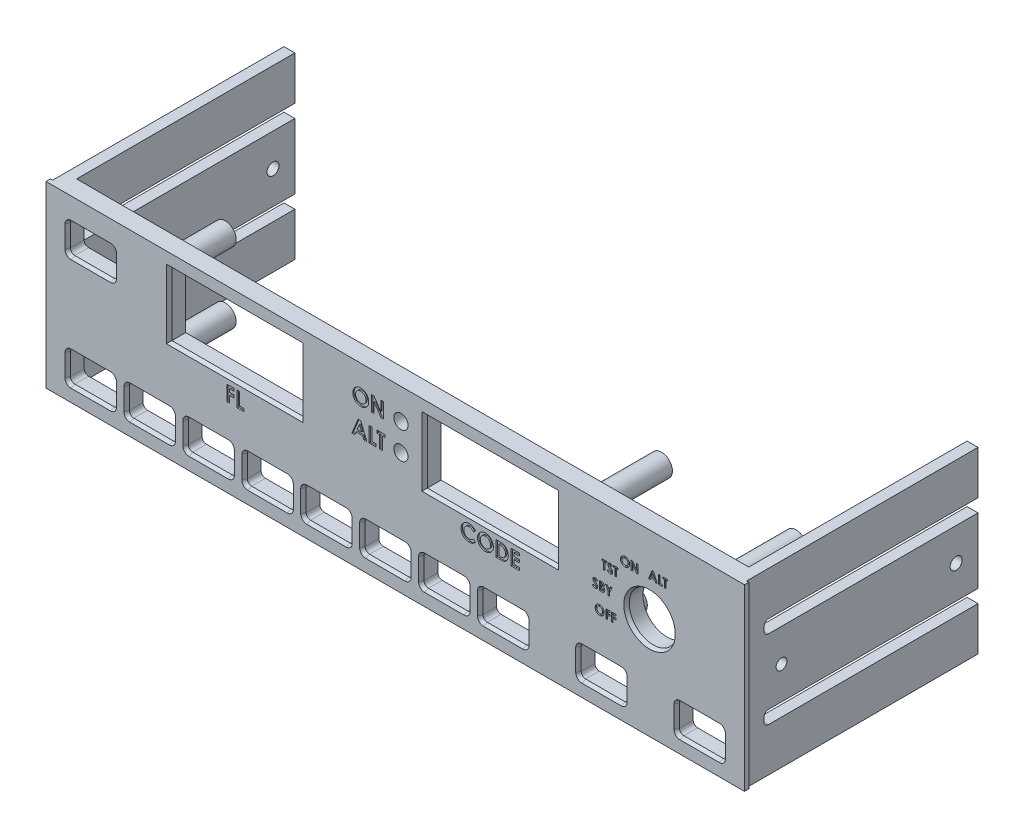
from build123d import *

# Parameters (mm, degrees)
ESQUISSE1_W             = 160
ESQUISSE1_H             = 41
BOSS_EXTRU_1_DEPTH      = 4
ESQUISSE2_R             = 5.5
ESQUISSE2_R_2           = 1.625
ESQUISSE2_W             = 30.5
ESQUISSE2_H             = 15
ENL_V_MAT_EXTRU_1_DEPTH = 4
ESQUISSE4_W             = 3
ESQUISSE4_H             = 41
BOSS_EXTRU_2_DEPTH      = 50
ENL_V_MAT_EXTRU_2_DEPTH = 173.571724219
ESQUISSE7_R             = 2.5
ESQUISSE7_R_2           = 1.25
BOSS_EXTRU_3_DEPTH      = 15
CHANFREIN1_SIZE         = 0.4
CHANFREIN1_SIZE2        = 0.857802768
ESQUISSE9_R             = 1.25
ESQUISSE9_R_2           = 1.375
ENL_V_MAT_EXTRU_3_DEPTH = 900
ENL_V_MAT_EXTRU_4_DEPTH = 0.3
ENL_V_START             = -1
ESQUISSE10_W            = 4.171279912
ESQUISSE10_H            = 57.921201065
ESQUISSE10_W_2          = 8.342559824
ESQUISSE10_H_2          = 64.595248924
ENL_V_MAT_EXTRU_5_DEPTH = 173.772840341


with BuildPart() as part:
    # Esquisse1 → Boss.-Extru.1 (new body)
    with BuildSketch(Plane.XY):
        with Locations((80, 20.5)):
            Rectangle(ESQUISSE1_W, ESQUISSE1_H)
    extrude(amount=BOSS_EXTRU_1_DEPTH)

    # Esquisse2 → Enlèv. mat.-Extru.1 (cut)
    with BuildSketch(Plane.XY.offset(4)):
        with Locations((138.25, 23.25)):
            Circle(ESQUISSE2_R)
        with Locations((81.3, 34.05)):
            Circle(ESQUISSE2_R_2)
        with Locations((81.3, 27.83)):
            Circle(ESQUISSE2_R_2)
        with BuildLine():
            Line((19.25, 10.25), (28.25, 10.25))
            ThreePointArc((28.25, 10.25), (28.957106781, 9.957106781), (29.25, 9.25))
            Line((29.25, 9.25), (29.25, 4.25))
            ThreePointArc((29.25, 4.25), (28.957106781, 3.542893219), (28.25, 3.25))
            Line((28.25, 3.25), (19.25, 3.25))
            ThreePointArc((19.25, 3.25), (18.542893219, 3.542893219), (18.25, 4.25))
            Line((18.25, 4.25), (18.25, 9.25))
            ThreePointArc((18.25, 9.25), (18.542893219, 9.957106781), (19.25, 10.25))
        make_face()
        with BuildLine():
            Line((5.75, 3.25), (14.75, 3.25))
            ThreePointArc((14.75, 3.25), (15.457106781, 3.542893219), (15.75, 4.25))
            Line((15.75, 4.25), (15.75, 9.25))
            ThreePointArc((15.75, 9.25), (15.457106781, 9.957106781), (14.75, 10.25))
            Line((14.75, 10.25), (5.75, 10.25))
            ThreePointArc((5.75, 10.25), (5.042893219, 9.957106781), (4.75, 9.25))
            Line((4.75, 9.25), (4.75, 4.25))
            ThreePointArc((4.75, 4.25), (5.042893219, 3.542893219), (5.75, 3.25))
        make_face()
        with BuildLine():
            Line((32.75, 10.25), (41.75, 10.25))
            ThreePointArc((41.75, 10.25), (42.457106781, 9.957106781), (42.75, 9.25))
            Line((42.75, 9.25), (42.75, 4.25))
            ThreePointArc((42.75, 4.25), (42.457106781, 3.542893219), (41.75, 3.25))
            Line((41.75, 3.25), (32.75, 3.25))
            ThreePointArc((32.75, 3.25), (32.042893219, 3.542893219), (31.75, 4.25))
            Line((31.75, 4.25), (31.75, 9.25))
            ThreePointArc((31.75, 9.25), (32.042893219, 9.957106781), (32.75, 10.25))
        make_face()
        with BuildLine():
            Line((46.25, 10.25), (55.25, 10.25))
            ThreePointArc((55.25, 10.25), (55.957106781, 9.957106781), (56.25, 9.25))
            Line((56.25, 9.25), (56.25, 4.25))
            ThreePointArc((56.25, 4.25), (55.957106781, 3.542893219), (55.25, 3.25))
            Line((55.25, 3.25), (46.25, 3.25))
            ThreePointArc((46.25, 3.25), (45.542893219, 3.542893219), (45.25, 4.25))
            Line((45.25, 4.25), (45.25, 9.25))
            ThreePointArc((45.25, 9.25), (45.542893219, 9.957106781), (46.25, 10.25))
        make_face()
        with BuildLine():
            Line((59.75, 10.25), (68.75, 10.25))
            ThreePointArc((68.75, 10.25), (69.457106781, 9.957106781), (69.75, 9.25))
            Line((69.75, 9.25), (69.75, 4.25))
            ThreePointArc((69.75, 4.25), (69.457106781, 3.542893219), (68.75, 3.25))
            Line((68.75, 3.25), (59.75, 3.25))
            ThreePointArc((59.75, 3.25), (59.042893219, 3.542893219), (58.75, 4.25))
            Line((58.75, 4.25), (58.75, 9.25))
            ThreePointArc((58.75, 9.25), (59.042893219, 9.957106781), (59.75, 10.25))
        make_face()
        with BuildLine():
            Line((73.25, 10.25), (82.25, 10.25))
            ThreePointArc((82.25, 10.25), (82.957106781, 9.957106781), (83.25, 9.25))
            Line((83.25, 9.25), (83.25, 4.25))
            ThreePointArc((83.25, 4.25), (82.957106781, 3.542893219), (82.25, 3.25))
            Line((82.25, 3.25), (73.25, 3.25))
            ThreePointArc((73.25, 3.25), (72.542893219, 3.542893219), (72.25, 4.25))
            Line((72.25, 4.25), (72.25, 9.25))
            ThreePointArc((72.25, 9.25), (72.542893219, 9.957106781), (73.25, 10.25))
        make_face()
        with BuildLine():
            Line((86.75, 10.25), (95.75, 10.25))
            ThreePointArc((95.75, 10.25), (96.457106781, 9.957106781), (96.75, 9.25))
            Line((96.75, 9.25), (96.75, 4.25))
            ThreePointArc((96.75, 4.25), (96.457106781, 3.542893219), (95.75, 3.25))
            Line((95.75, 3.25), (86.75, 3.25))
            ThreePointArc((86.75, 3.25), (86.042893219, 3.542893219), (85.75, 4.25))
            Line((85.75, 4.25), (85.75, 9.25))
            ThreePointArc((85.75, 9.25), (86.042893219, 9.957106781), (86.75, 10.25))
        make_face()
        with BuildLine():
            Line((100.25, 10.25), (109.25, 10.25))
            ThreePointArc((109.25, 10.25), (109.957106781, 9.957106781), (110.25, 9.25))
            Line((110.25, 9.25), (110.25, 4.25))
            ThreePointArc((110.25, 4.25), (109.957106781, 3.542893219), (109.25, 3.25))
            Line((109.25, 3.25), (100.25, 3.25))
            ThreePointArc((100.25, 3.25), (99.542893219, 3.542893219), (99.25, 4.25))
            Line((99.25, 4.25), (99.25, 9.25))
            ThreePointArc((99.25, 9.25), (99.542893219, 9.957106781), (100.25, 10.25))
        make_face()
        with BuildLine():
            Line((122.75, 3.25), (131.75, 3.25))
            ThreePointArc((131.75, 3.25), (132.457106781, 3.542893219), (132.75, 4.25))
            Line((132.75, 4.25), (132.75, 9.25))
            ThreePointArc((132.75, 9.25), (132.457106781, 9.957106781), (131.75, 10.25))
            Line((131.75, 10.25), (122.75, 10.25))
            ThreePointArc((122.75, 10.25), (122.042893219, 9.957106781), (121.75, 9.25))
            Line((121.75, 9.25), (121.75, 4.25))
            ThreePointArc((121.75, 4.25), (122.042893219, 3.542893219), (122.75, 3.25))
        make_face()
        with BuildLine():
            Line((145.25, 3.25), (154.25, 3.25))
            ThreePointArc((154.25, 3.25), (154.957106781, 3.542893219), (155.25, 4.25))
            Line((155.25, 4.25), (155.25, 9.25))
            ThreePointArc((155.25, 9.25), (154.957106781, 9.957106781), (154.25, 10.25))
            Line((154.25, 10.25), (145.25, 10.25))
            ThreePointArc((145.25, 10.25), (144.542893219, 9.957106781), (144.25, 9.25))
            Line((144.25, 9.25), (144.25, 4.25))
            ThreePointArc((144.25, 4.25), (144.542893219, 3.542893219), (145.25, 3.25))
        make_face()
        with BuildLine():
            Line((5.75, 35.75), (14.75, 35.75))
            ThreePointArc((14.75, 35.75), (15.457106781, 35.457106781), (15.75, 34.75))
            Line((15.75, 34.75), (15.75, 29.75))
            ThreePointArc((15.75, 29.75), (15.457106781, 29.042893219), (14.75, 28.75))
            Line((14.75, 28.75), (5.75, 28.75))
            ThreePointArc((5.75, 28.75), (5.042893219, 29.042893219), (4.75, 29.75))
            Line((4.75, 29.75), (4.75, 34.75))
            ThreePointArc((4.75, 34.75), (5.042893219, 35.457106781), (5.75, 35.75))
        make_face()
        with Locations((43.25, 30.5)):
            Rectangle(ESQUISSE2_W, ESQUISSE2_H)
        with Locations((101.75, 30.5)):
            Rectangle(ESQUISSE2_W, ESQUISSE2_H)
    extrude(amount=-ENL_V_MAT_EXTRU_1_DEPTH, mode=Mode.SUBTRACT)

    # Esquisse4 → Boss.-Extru.2 (add)
    with BuildSketch(Plane(origin=(0, 0, 0), x_dir=(-1, 0, 0), z_dir=(0, 0, -1))):
        with Locations((-158.5, 20.5)):
            Rectangle(ESQUISSE4_W, ESQUISSE4_H)
        with Locations((-1.5, 20.5)):
            Rectangle(ESQUISSE4_W, ESQUISSE4_H)
    extrude(amount=BOSS_EXTRU_2_DEPTH)

    # Esquisse5 → Enlèv. mat.-Extru.2 (cut, through all)
    with BuildSketch(Plane(origin=(160, 0, 0), x_dir=(0, 0, -1), z_dir=(1, 0, 0))):
        with BuildLine():
            Line((50, 13), (2, 13))
            ThreePointArc((2, 13), (1.292893219, 12.707106781), (1, 12))
            Line((1, 12), (1, 11))
            ThreePointArc((1, 11), (1.292893219, 10.292893219), (2, 10))
            Line((2, 10), (50, 10))
            Line((50, 10), (50, 13))
        make_face()
        with BuildLine():
            Line((50, 31), (2, 31))
            ThreePointArc((2, 31), (1.292893219, 30.707106781), (1, 30))
            Line((1, 30), (1, 29))
            ThreePointArc((1, 29), (1.292893219, 28.292893219), (2, 28))
            Line((2, 28), (50, 28))
            Line((50, 28), (50, 31))
        make_face()
    extrude(amount=-ENL_V_MAT_EXTRU_2_DEPTH, mode=Mode.SUBTRACT)

    # Esquisse7 → Boss.-Extru.3 (add)
    # profile 1 of 7: a face of its own
    with BuildSketch(Plane(origin=(0, 0, 0), x_dir=(-1, 0, 0), z_dir=(0, 0, -1))):
        with Locations((-22.066417501, 32.220467417)):
            Circle(ESQUISSE7_R)
        with Locations((-22.066417501, 32.220467417)):
            Circle(ESQUISSE7_R_2, mode=Mode.SUBTRACT)
    # profile 2 of 7: a face of its own
    with BuildSketch(Plane(origin=(0, 0, 0), x_dir=(-1, 0, 0), z_dir=(0, 0, -1))):
        with Locations((-22.066417501, 15.960655172)):
            Circle(ESQUISSE7_R)
        with Locations((-22.066417501, 15.960655172)):
            Circle(ESQUISSE7_R_2, mode=Mode.SUBTRACT)
    # profile 3 of 7: a face of its own
    with BuildSketch(Plane(origin=(0, 0, 0), x_dir=(-1, 0, 0), z_dir=(0, 0, -1))):
        with Locations((-152.81245368, 36.297265299)):
            Circle(ESQUISSE7_R)
        with Locations((-152.81245368, 36.297265299)):
            Circle(ESQUISSE7_R_2, mode=Mode.SUBTRACT)
    # profile 4 of 7: a face of its own
    with BuildSketch(Plane(origin=(0, 0, 0), x_dir=(-1, 0, 0), z_dir=(0, 0, -1))):
        with Locations((-152.81245368, 14.495559759)):
            Circle(ESQUISSE7_R)
        with Locations((-152.81245368, 14.495559759)):
            Circle(ESQUISSE7_R_2, mode=Mode.SUBTRACT)
    # profile 5 of 7: a face of its own
    with BuildSketch(Plane(origin=(0, 0, 0), x_dir=(-1, 0, 0), z_dir=(0, 0, -1))):
        with Locations((-122, 36.297265299)):
            Circle(ESQUISSE7_R)
        with Locations((-122, 36.297265299)):
            Circle(ESQUISSE7_R_2, mode=Mode.SUBTRACT)
    # profile 6 of 7: a face of its own
    with BuildSketch(Plane(origin=(0, 0, 0), x_dir=(-1, 0, 0), z_dir=(0, 0, -1))):
        with Locations((-116.25, 6.75)):
            Circle(ESQUISSE7_R)
        with Locations((-116.25, 6.75)):
            Circle(ESQUISSE7_R_2, mode=Mode.SUBTRACT)
    # profile 7 of 7: a face of its own
    with BuildSketch(Plane(origin=(0, 0, 0), x_dir=(-1, 0, 0), z_dir=(0, 0, -1))):
        with Locations((-63.5, 14.495559759)):
            Circle(ESQUISSE7_R)
        with Locations((-63.5, 14.495559759)):
            Circle(ESQUISSE7_R_2, mode=Mode.SUBTRACT)
    extrude(amount=BOSS_EXTRU_3_DEPTH)

    # Chanfrein1
    chanfrein1_edges = [part.edges().sort_by_distance(p)[0] for p in [
        (59.042893219, 3.542893219, 4),
        (64.25, 3.25, 4),
        (69.457106781, 3.542893219, 4),
        (69.75, 6.75, 4),
        (69.457106781, 9.957106781, 4),
        (64.25, 10.25, 4),
        (59.042893219, 9.957106781, 4),
        (58.75, 6.75, 4),
        (72.542893219, 3.542893219, 4),
        (77.75, 3.25, 4),
        (82.957106781, 3.542893219, 4),
        (83.25, 6.75, 4),
        (82.957106781, 9.957106781, 4),
        (77.75, 10.25, 4),
        (72.542893219, 9.957106781, 4),
        (72.25, 6.75, 4),
        (86.042893219, 3.542893219, 4),
        (91.25, 3.25, 4),
        (96.457106781, 3.542893219, 4),
        (96.75, 6.75, 4),
        (96.457106781, 9.957106781, 4),
        (91.25, 10.25, 4),
        (86.042893219, 9.957106781, 4),
        (85.75, 6.75, 4),
        (99.542893219, 3.542893219, 4),
        (104.75, 3.25, 4),
        (109.957106781, 3.542893219, 4),
        (110.25, 6.75, 4),
        (109.957106781, 9.957106781, 4),
        (104.75, 10.25, 4),
        (99.542893219, 9.957106781, 4),
        (99.25, 6.75, 4),
        (154.957106781, 3.542893219, 4),
        (155.25, 6.75, 4),
        (154.957106781, 9.957106781, 4),
        (149.75, 10.25, 4),
        (144.542893219, 9.957106781, 4),
        (144.25, 6.75, 4),
        (144.542893219, 3.542893219, 4),
        (149.75, 3.25, 4),
        (132.457106781, 3.542893219, 4),
        (132.75, 6.75, 4),
        (132.457106781, 9.957106781, 4),
        (127.25, 10.25, 4),
        (122.042893219, 9.957106781, 4),
        (121.75, 6.75, 4),
        (122.042893219, 3.542893219, 4),
        (127.25, 3.25, 4),
        (5.042893219, 3.542893219, 4),
        (10.25, 3.25, 4),
        (15.457106781, 3.542893219, 4),
        (15.75, 6.75, 4),
        (15.457106781, 9.957106781, 4),
        (10.25, 10.25, 4),
        (5.042893219, 9.957106781, 4),
        (4.75, 6.75, 4),
        (15.457106781, 35.457106781, 4),
        (10.25, 35.75, 4),
        (5.042893219, 35.457106781, 4),
        (4.75, 32.25, 4),
        (5.042893219, 29.042893219, 4),
        (10.25, 28.75, 4),
        (15.457106781, 29.042893219, 4),
        (15.75, 32.25, 4),
        (132.75, 23.25, 4),
        (28, 30.5, 4),
        (43.25, 23, 4),
        (58.5, 30.5, 4),
        (43.25, 38, 4),
        (86.5, 30.5, 4),
        (101.75, 23, 4),
        (117, 30.5, 4),
        (101.75, 38, 4),
        (18.542893219, 3.542893219, 4),
        (23.75, 3.25, 4),
        (28.957106781, 3.542893219, 4),
        (29.25, 6.75, 4),
        (28.957106781, 9.957106781, 4),
        (23.75, 10.25, 4),
        (18.542893219, 9.957106781, 4),
        (18.25, 6.75, 4),
        (32.042893219, 3.542893219, 4),
        (37.25, 3.25, 4),
        (42.457106781, 3.542893219, 4),
        (42.75, 6.75, 4),
        (42.457106781, 9.957106781, 4),
        (37.25, 10.25, 4),
        (32.042893219, 9.957106781, 4),
        (31.75, 6.75, 4),
        (45.542893219, 3.542893219, 4),
        (50.75, 3.25, 4),
        (55.957106781, 3.542893219, 4),
        (56.25, 6.75, 4),
        (55.957106781, 9.957106781, 4),
        (50.75, 10.25, 4),
        (45.542893219, 9.957106781, 4),
        (45.25, 6.75, 4),
    ]]
    chanfrein1_side = [part.faces().sort_by_distance(p)[0] for p in [
        (82.430470131, 20.497923343, 4),
    ]]
    chamfer(chanfrein1_edges, length=CHANFREIN1_SIZE, length2=CHANFREIN1_SIZE2, reference=chanfrein1_side[0])

    # Esquisse9 → Enlèv. mat.-Extru.3 (cut)
    with BuildSketch(Plane(origin=(160, 0, 0), x_dir=(0, 0, -1), z_dir=(1, 0, 0))):
        with Locations((5, 20.5)):
            Circle(ESQUISSE9_R)
        with Locations((45, 20.5)):
            Circle(ESQUISSE9_R_2)
    extrude(amount=-ENL_V_MAT_EXTRU_3_DEPTH, mode=Mode.SUBTRACT)

    # Esquisse8 → Enlèv. mat.-Extru.4 (cut)
    # profile 1 of 25: a face of its own
    with BuildSketch(Plane.XY.offset(4)):
        Polygon((129.575536536, 20.385193728), (130.549895511, 20.385193728), (130.549895511, 20.026219369), (129.934510895, 20.026219369), (129.934510895, 19.641603984), (130.549895511, 19.641603984), (130.549895511, 19.282629625), (129.934510895, 19.282629625), (129.934510895, 18.385193728), (129.575536536, 18.385193728), align=None)
    # profile 2 of 25: a face of its own
    with BuildSketch(Plane.XY.offset(4)):
        Polygon((128.242203203, 20.385193728), (129.216562177, 20.385193728), (129.216562177, 20.026219369), (128.601177562, 20.026219369), (128.601177562, 19.641603984), (129.216562177, 19.641603984), (129.216562177, 19.282629625), (128.601177562, 19.282629625), (128.601177562, 18.385193728), (128.242203203, 18.385193728), align=None)
    # profile 3 of 25: a face of its own
    with BuildSketch(Plane.XY.offset(4)):
        with BuildLine():
            add(Edge.make_bspline(
                [(126.848773716, 20.436475779), (126.883546167, 20.435575458), (126.952194861, 20.433798021), (127.053152318, 20.418981691), (127.150443494, 20.394840605), (127.244024396, 20.36128275), (127.333660706, 20.317399209), (127.419668603, 20.264434108), (127.501740011, 20.201387763), (127.579033926, 20.129730941), (127.650467445, 20.051807276), (127.71236463, 19.967908597), (127.765148279, 19.880208803), (127.808895508, 19.7884729), (127.842217166, 19.692065573), (127.865600352, 19.591478371), (127.88062289, 19.486739912), (127.882350713, 19.415427297), (127.883228844, 19.379184112)],
                knots=[0, 0, 0, 0, 1.014329547, 2.002516266, 2.970391464, 3.935626869, 4.897733899, 5.877609409, 6.878433252, 7.912639331, 8.949961323, 9.958554974, 10.949718813, 11.932905612, 12.9188844, 13.919928257, 14.942845884, 16, 16, 16, 16], degree=3))
            add(Edge.make_bspline(
                [(127.883228844, 19.379184112), (127.882293673, 19.343349305), (127.880450887, 19.272735667), (127.866213638, 19.168962413), (127.842436676, 19.06945271), (127.80968018, 18.973981315), (127.76672636, 18.883010659), (127.714972049, 18.795959906), (127.653051551, 18.713636909), (127.583223349, 18.636085844), (127.506348557, 18.565691613), (127.42492595, 18.503656818), (127.339331485, 18.451090873), (127.249690447, 18.408017858), (127.155810603, 18.374590476), (127.057923849, 18.35100503), (126.956036242, 18.336671678), (126.886747728, 18.334840929), (126.851578203, 18.333911677)],
                knots=[0, 0, 0, 0, 1.051557043, 2.072126891, 3.067553643, 4.050577992, 5.02905126, 6.015227836, 7.017913613, 8.04756643, 9.074058332, 10.072836633, 11.047628519, 12.017157415, 12.98668631, 13.966869689, 14.968021931, 16, 16, 16, 16], degree=3))
            add(Edge.make_bspline(
                [(126.851578203, 18.333911677), (126.814795097, 18.334745262), (126.742521322, 18.336383144), (126.636748328, 18.351958652), (126.535408661, 18.375420808), (126.439353631, 18.410436818), (126.347605001, 18.454209774), (126.260836874, 18.508118794), (126.17907841, 18.572074789), (126.10279859, 18.644439823), (126.033688888, 18.723623041), (125.97268602, 18.807273089), (125.921228748, 18.894750955), (125.879315189, 18.986097579), (125.846272222, 19.080745264), (125.822964163, 19.179270443), (125.809195537, 19.281436817), (125.807277647, 19.35083026), (125.806305767, 19.38599501)],
                knots=[0, 0, 0, 0, 1.067978421, 2.098431617, 3.099715153, 4.085208694, 5.062210972, 6.048429807, 7.046490867, 8.072918869, 9.098532598, 10.095778865, 11.076610158, 12.041847152, 13.011192615, 13.984257998, 14.978533688, 16, 16, 16, 16], degree=3))
            add(Edge.make_bspline(
                [(125.806305767, 19.38599501), (125.806610799, 19.409652013), (125.807217001, 19.456666467), (125.814519337, 19.526339489), (125.825032603, 19.594652587), (125.840581223, 19.661333395), (125.859468823, 19.726852317), (125.883940376, 19.790599485), (125.911795627, 19.853255894), (125.944341864, 19.914081495), (125.980530134, 19.972516641), (126.020014757, 20.028285682), (126.062895019, 20.08071429), (126.109032787, 20.130147004), (126.158587059, 20.176258898), (126.210905999, 20.219702752), (126.26700429, 20.259324542), (126.325654116, 20.296091911), (126.386524823, 20.329340005), (126.449368613, 20.357639788), (126.512890779, 20.382353507), (126.577939891, 20.401858666), (126.643818832, 20.417745415), (126.711231386, 20.428251594), (126.779568519, 20.435553728), (126.825650571, 20.436167699), (126.848773716, 20.436475779)],
                knots=[0, 0, 0, 0, 1.034744296, 2.056386356, 3.06226378, 4.057406941, 5.050368692, 6.043467995, 7.042652155, 8.049140477, 9.059438543, 10.048523776, 11.036952808, 12.020949711, 13.004946614, 13.997082645, 14.994316842, 16.007702937, 17.024872941, 18.026463647, 19.021641123, 20.005082605, 20.995858141, 21.984425357, 22.988620895, 24, 24, 24, 24], degree=3))
        make_face()
        with BuildLine():
            add(Edge.make_bspline(
                [(126.843164741, 20.07750142), (126.819762886, 20.076873496), (126.773576989, 20.075634225), (126.705830689, 20.066192653), (126.640791849, 20.051113391), (126.578821004, 20.029271263), (126.519649567, 20.001471778), (126.463172647, 19.967812071), (126.410172331, 19.927135126), (126.359941911, 19.881624708), (126.314566993, 19.830915643), (126.274476821, 19.776572257), (126.240927804, 19.7186853), (126.212830292, 19.65779253), (126.191679093, 19.593209224), (126.176613728, 19.525441269), (126.16709298, 19.454371898), (126.165892878, 19.405924001), (126.165280126, 19.381187318)],
                knots=[0, 0, 0, 0, 1.033739768, 2.040188636, 3.016340934, 3.979330865, 4.937572243, 5.900995986, 6.878200029, 7.884839167, 8.891893314, 9.879764717, 10.863503415, 11.843163062, 12.837761627, 13.859916423, 14.907309254, 16, 16, 16, 16], degree=3))
            add(Edge.make_bspline(
                [(126.165280126, 19.381187318), (126.166092542, 19.353773508), (126.167684742, 19.300046984), (126.178887654, 19.221672178), (126.198054723, 19.147654953), (126.225731597, 19.078357315), (126.260058183, 19.013009767), (126.302686354, 18.952413234), (126.352925736, 18.896204895), (126.391629749, 18.863388125), (126.411273716, 18.846732189)],
                knots=[0, 0, 0, 0, 1.078454662, 2.113592447, 3.107694534, 4.079536787, 5.043276885, 6.005368276, 6.987637804, 8, 8, 8, 8], degree=3))
            add(Edge.make_bspline(
                [(126.411273716, 18.846732189), (126.427365875, 18.834427424), (126.459187634, 18.810095122), (126.50998209, 18.778908285), (126.562290378, 18.752178054), (126.616507229, 18.730580344), (126.67251814, 18.713591948), (126.730315431, 18.701695254), (126.789817207, 18.69422905), (126.830055096, 18.693336697), (126.85037628, 18.692886036)],
                knots=[0, 0, 0, 0, 1.023928204, 2.024787132, 3.009472467, 3.9914905, 4.972207045, 5.96565515, 6.972602802, 8, 8, 8, 8], degree=3))
            add(Edge.make_bspline(
                [(126.85037628, 18.692886036), (126.873375739, 18.693519284), (126.918627899, 18.69476522), (126.985113065, 18.704090561), (127.048807874, 18.719872403), (127.110107747, 18.741522924), (127.168835925, 18.769671456), (127.224705385, 18.804375181), (127.277814082, 18.845207985), (127.327980509, 18.891316054), (127.373834994, 18.942224878), (127.413841507, 18.996858127), (127.448457214, 19.054012067), (127.475970438, 19.114495626), (127.497957273, 19.177737868), (127.512841318, 19.244018878), (127.522442495, 19.313065421), (127.523642936, 19.360054034), (127.524254485, 19.383991805)],
                knots=[0, 0, 0, 0, 1.026359118, 2.019393844, 2.989460624, 3.950973911, 4.916101784, 5.890408035, 6.881132271, 7.902007068, 8.92769091, 9.933912415, 10.920395702, 11.90457117, 12.894218921, 13.903490204, 14.931958862, 16, 16, 16, 16], degree=3))
            add(Edge.make_bspline(
                [(127.524254485, 19.383991805), (127.523621776, 19.407791927), (127.522376384, 19.454638838), (127.513034631, 19.523507863), (127.497352872, 19.589496262), (127.475637337, 19.652711801), (127.447907749, 19.713216454), (127.4136173, 19.770797452), (127.372886311, 19.825399127), (127.326652204, 19.876649391), (127.27632922, 19.9237451), (127.222302468, 19.964615615), (127.166083678, 20.000130792), (127.106382916, 20.027951949), (127.044421611, 20.050117005), (126.979821669, 20.06643967), (126.912338416, 20.075567897), (126.866428164, 20.076851168), (126.843164741, 20.07750142)],
                knots=[0, 0, 0, 0, 1.055025985, 2.07665775, 3.074803781, 4.057872707, 5.035505728, 6.020516407, 7.023567878, 8.050795229, 9.077271434, 10.074415901, 11.050397877, 12.019801805, 12.988065821, 13.964604439, 14.968634123, 16, 16, 16, 16], degree=3))
        make_face(mode=Mode.SUBTRACT)
    # profile 4 of 25: a face of its own
    with BuildSketch(Plane.XY.offset(4)):
        with BuildLine():
            Line((126.343168247, 24.982772436), (126.07473876, 24.737179487))
            add(Edge.make_bspline(
                [(126.07473876, 24.737179487), (126.063240392, 24.753399131), (126.041165128, 24.784538585), (126.005383429, 24.826235048), (125.969763302, 24.861805234), (125.933974749, 24.891100547), (125.897700554, 24.913942997), (125.861003683, 24.930115703), (125.824092181, 24.940396846), (125.79929335, 24.941677096), (125.787078504, 24.942307692)],
                knots=[0, 0, 0, 0, 1.299362458, 2.494594718, 3.587462134, 4.587049575, 5.512617175, 6.380583204, 7.202344345, 8, 8, 8, 8], degree=3))
            add(Edge.make_bspline(
                [(125.787078504, 24.942307692), (125.775684845, 24.941908118), (125.753686684, 24.941136644), (125.722326673, 24.93346825), (125.694484808, 24.920233729), (125.670188263, 24.902928479), (125.650941815, 24.882079664), (125.635575018, 24.860214619), (125.62692222, 24.836080553), (125.625783342, 24.819504304), (125.625219529, 24.811298077)],
                knots=[0, 0, 0, 0, 1.185010067, 2.2879431, 3.333075148, 4.379039566, 5.372662701, 6.27520591, 7.14612461, 8, 8, 8, 8], degree=3))
            add(Edge.make_bspline(
                [(125.625219529, 24.811298077), (125.625572842, 24.802973513), (125.626284365, 24.786208997), (125.633156704, 24.761638511), (125.643515282, 24.737630287), (125.653413325, 24.723015338), (125.658472734, 24.715544872)],
                knots=[0, 0, 0, 0, 0.967525499, 1.948461899, 2.951351359, 4, 4, 4, 4], degree=3))
            add(Edge.make_bspline(
                [(125.658472734, 24.715544872), (125.663072285, 24.709738157), (125.673659841, 24.696371865), (125.693848144, 24.675201743), (125.719200412, 24.64926649), (125.750692254, 24.619457943), (125.787016357, 24.584704072), (125.82985639, 24.546371064), (125.877979231, 24.503271789), (125.912183831, 24.473259015), (125.93010735, 24.457532051)],
                knots=[0, 0, 0, 0, 0.473873513, 1.090794244, 1.870441696, 2.795289791, 3.865433203, 5.087734844, 6.473946851, 8, 8, 8, 8], degree=3))
            add(Edge.make_bspline(
                [(125.93010735, 24.457532051), (125.94693115, 24.442971901), (125.978859228, 24.41533976), (126.024286542, 24.376120373), (126.064209585, 24.340835647), (126.099209945, 24.310015129), (126.128757051, 24.283335443), (126.152975118, 24.26066906), (126.172159929, 24.242457252), (126.183065371, 24.231457309), (126.187719529, 24.226762821)],
                knots=[0, 0, 0, 0, 1.543621617, 2.929473131, 4.163658386, 5.240097082, 6.164993805, 6.925417477, 7.541396219, 8, 8, 8, 8], degree=3))
            add(Edge.make_bspline(
                [(126.187719529, 24.226762821), (126.205376435, 24.207654267), (126.239319208, 24.170920917), (126.283432847, 24.113995777), (126.319739799, 24.058425234), (126.347827546, 24.003163636), (126.369040542, 23.94741367), (126.383995985, 23.88980807), (126.392952899, 23.829744893), (126.393947326, 23.788759108), (126.394450299, 23.768028846)],
                knots=[0, 0, 0, 0, 1.206664779, 2.319633467, 3.337109185, 4.282041471, 5.190008762, 6.099243693, 7.03861361, 8, 8, 8, 8], degree=3))
            add(Edge.make_bspline(
                [(126.394450299, 23.768028846), (126.394092296, 23.747829748), (126.39338988, 23.708198366), (126.384786642, 23.650203742), (126.372518928, 23.59470037), (126.353550891, 23.542292204), (126.33043276, 23.492118982), (126.301450844, 23.444962242), (126.267415557, 23.400344738), (126.228405893, 23.359064064), (126.185256571, 23.321604713), (126.138974824, 23.288257514), (126.089108083, 23.260725154), (126.036082403, 23.238054219), (125.979926168, 23.220592762), (125.920706275, 23.207687118), (125.858332145, 23.199941354), (125.815679816, 23.199131626), (125.793889401, 23.198717949)],
                knots=[0, 0, 0, 0, 1.043214005, 2.046824704, 3.02475056, 3.976699089, 4.921714032, 5.875962561, 6.831408892, 7.817874052, 8.806269674, 9.781291748, 10.760897367, 11.74438705, 12.757449933, 13.795994037, 14.874007457, 16, 16, 16, 16], degree=3))
            add(Edge.make_bspline(
                [(125.793889401, 23.198717949), (125.776784111, 23.199021408), (125.742905827, 23.199622431), (125.692974357, 23.204529287), (125.644759879, 23.212448429), (125.598316701, 23.223798925), (125.55343559, 23.238181544), (125.510114701, 23.255749362), (125.468653092, 23.276774673), (125.428737047, 23.300825114), (125.390560607, 23.328750844), (125.353641044, 23.359980931), (125.318345079, 23.394995707), (125.284503193, 23.433712363), (125.252331916, 23.476240537), (125.220778167, 23.521987944), (125.191244288, 23.571803594), (125.172999898, 23.606749676), (125.163681068, 23.624599359)],
                knots=[0, 0, 0, 0, 1.016823716, 2.013894106, 2.979844003, 3.91962641, 4.853723003, 5.779685073, 6.695824784, 7.614987388, 8.547259901, 9.504950863, 10.487499108, 11.500346958, 12.559593716, 13.656357062, 14.802919212, 16, 16, 16, 16], degree=3))
            Line((125.163681068, 23.624599359), (125.479386196, 23.814102564))
            add(Edge.make_bspline(
                [(125.479386196, 23.814102564), (125.491042659, 23.793840842), (125.513389095, 23.754997389), (125.551257221, 23.702806287), (125.590051182, 23.658113247), (125.63066786, 23.621708221), (125.672613373, 23.593104429), (125.716090326, 23.572662175), (125.761129265, 23.560008442), (125.791807744, 23.558463129), (125.807110555, 23.557692308)],
                knots=[0, 0, 0, 0, 1.283663364, 2.460892379, 3.537111102, 4.529833553, 5.449777664, 6.316464042, 7.160231139, 8, 8, 8, 8], degree=3))
            add(Edge.make_bspline(
                [(125.807110555, 23.557692308), (125.822675704, 23.558321802), (125.85287436, 23.559543114), (125.895979078, 23.570823998), (125.935499115, 23.588535813), (125.969659943, 23.613808132), (125.998585178, 23.642976228), (126.019933662, 23.675427069), (126.033344924, 23.710538096), (126.034762819, 23.734928525), (126.03547594, 23.747195513)],
                knots=[0, 0, 0, 0, 1.13588714, 2.203786484, 3.234766741, 4.283437687, 5.291419208, 6.222934724, 7.106237994, 8, 8, 8, 8], degree=3))
            add(Edge.make_bspline(
                [(126.03547594, 23.747195513), (126.034817402, 23.758607949), (126.033479647, 23.781791221), (126.023626152, 23.816261017), (126.008222134, 23.850715138), (125.989998095, 23.87897534), (125.971452853, 23.902636841), (125.953719419, 23.923138461), (125.932124787, 23.945789163), (125.906723712, 23.970617438), (125.877851809, 23.997841856), (125.845484756, 24.027459752), (125.809251916, 24.059210227), (125.783642474, 24.080838337), (125.770251581, 24.092147436)],
                knots=[0, 0, 0, 0, 0.916159276, 1.861089862, 2.860218735, 3.940849679, 4.552606315, 5.27541173, 6.11797699, 7.06649574, 8.129236253, 9.306560635, 10.591630461, 12, 12, 12, 12], degree=3))
            add(Edge.make_bspline(
                [(125.770251581, 24.092147436), (125.74479496, 24.113686178), (125.695935999, 24.155025544), (125.626892089, 24.216082486), (125.564677344, 24.273145792), (125.509829118, 24.326920891), (125.461648558, 24.376414681), (125.420461965, 24.422029169), (125.386721793, 24.464116208), (125.351217536, 24.513965489), (125.317481394, 24.574710264), (125.288323794, 24.64779327), (125.269407573, 24.720867003), (125.267288274, 24.769924682), (125.26624517, 24.794070513)],
                knots=[0, 0, 0, 0, 1.345494975, 2.582412109, 3.71882943, 4.751509156, 5.681369928, 6.505683931, 7.230279997, 7.856715994, 8.973648664, 10.023341002, 11.027102913, 12, 12, 12, 12], degree=3))
            add(Edge.make_bspline(
                [(125.26624517, 24.794070513), (125.266678996, 24.81119344), (125.267533678, 24.844927446), (125.27515758, 24.894528386), (125.286551791, 24.942389125), (125.303099456, 24.988335047), (125.324576328, 25.0323086), (125.350659155, 25.074525056), (125.381752953, 25.114595862), (125.416793564, 25.152494455), (125.455399347, 25.187129457), (125.496654532, 25.217698316), (125.54032561, 25.243517218), (125.586145426, 25.264935873), (125.634397904, 25.281330493), (125.684727572, 25.292951816), (125.737206618, 25.299863809), (125.772901732, 25.300803414), (125.791084914, 25.301282051)],
                knots=[0, 0, 0, 0, 1.010766082, 1.991317756, 2.957454644, 3.913069143, 4.869106762, 5.843196583, 6.838735724, 7.860187025, 8.887984031, 9.89767229, 10.887916223, 11.879572884, 12.879850636, 13.892031539, 14.926195476, 16, 16, 16, 16], degree=3))
            add(Edge.make_bspline(
                [(125.791084914, 25.301282051), (125.814649418, 25.300420012), (125.861592417, 25.298702737), (125.930998995, 25.285274208), (125.998792438, 25.264156432), (126.053421665, 25.238680159), (126.096889121, 25.214001281), (126.130202866, 25.191280079), (126.164101394, 25.165251721), (126.198858077, 25.135834185), (126.233827081, 25.102473205), (126.270002742, 25.065962967), (126.306892123, 25.025987936), (126.330864372, 24.997429959), (126.343168247, 24.982772436)],
                knots=[0, 0, 0, 0, 1.282922637, 2.555718331, 3.837320111, 5.142675274, 5.830281639, 6.55870424, 7.337177975, 8.157850921, 9.037902056, 9.96903443, 10.957596896, 12, 12, 12, 12], degree=3))
        make_face()
    # profile 5 of 25: a face of its own
    with BuildSketch(Plane.XY.offset(4)):
        with BuildLine():
            Line((126.753424658, 23.25), (126.753424658, 25.25))
            Line((126.753424658, 25.25), (127.073937478, 25.25))
            add(Edge.make_bspline(
                [(127.073937478, 25.25), (127.09637538, 25.250002561), (127.139792294, 25.250007516), (127.20243157, 25.24780783), (127.260524208, 25.24496229), (127.313885336, 25.241778793), (127.362605777, 25.23629299), (127.406611445, 25.230511554), (127.445990262, 25.223539498), (127.470336044, 25.217285348), (127.481790042, 25.214342949)],
                knots=[0, 0, 0, 0, 1.311965854, 2.538629056, 3.664479157, 4.713267157, 5.663616078, 6.530575999, 7.308677837, 8, 8, 8, 8], degree=3))
            add(Edge.make_bspline(
                [(127.481790042, 25.214342949), (127.496830304, 25.210192642), (127.526344126, 25.202048407), (127.568617338, 25.185600773), (127.608719377, 25.167318062), (127.646601278, 25.146460908), (127.682030432, 25.122777506), (127.714872197, 25.096079899), (127.745834886, 25.067439727), (127.773819088, 25.036058797), (127.799112195, 25.002899031), (127.82108737, 24.967969118), (127.840180981, 24.931803159), (127.85546087, 24.893946031), (127.86697398, 24.854572074), (127.875394621, 24.813849423), (127.880852336, 24.77164922), (127.881368019, 24.742939043), (127.881629786, 24.728365385)],
                knots=[0, 0, 0, 0, 1.099996261, 2.158545794, 3.195537121, 4.207578794, 5.205712374, 6.197378256, 7.190519799, 8.17788031, 9.159561366, 10.129234751, 11.085776129, 12.040971148, 13.00380137, 13.975669004, 14.972423361, 16, 16, 16, 16], degree=3))
            add(Edge.make_bspline(
                [(127.881629786, 24.728365385), (127.880945342, 24.709642059), (127.8795981, 24.672787494), (127.870991823, 24.618654806), (127.854853714, 24.567491635), (127.83373739, 24.518355063), (127.805025791, 24.47142837), (127.768567613, 24.426733869), (127.72495336, 24.382895348), (127.69149882, 24.356617112), (127.674097734, 24.342948718)],
                knots=[0, 0, 0, 0, 0.986156485, 1.941127874, 2.875419072, 3.804401753, 4.751181392, 5.761612777, 6.835722519, 8, 8, 8, 8], degree=3))
            add(Edge.make_bspline(
                [(127.674097734, 24.342948718), (127.688198739, 24.335750277), (127.715846909, 24.321636127), (127.755099187, 24.298436676), (127.791442511, 24.273761118), (127.825039835, 24.248105935), (127.855186416, 24.220383566), (127.883127056, 24.192191413), (127.90748331, 24.161914182), (127.929263407, 24.130631011), (127.948194312, 24.097888916), (127.964681044, 24.063743192), (127.978606794, 24.028077189), (127.99039948, 23.991072419), (127.999194469, 23.952601601), (128.004928988, 23.912650978), (128.009319694, 23.871356802), (128.00966125, 23.84322824), (128.009834914, 23.828926282)],
                knots=[0, 0, 0, 0, 1.164658916, 2.283573913, 3.35186032, 4.395461096, 5.390182219, 6.362969632, 7.312859996, 8.245001507, 9.165155236, 10.092416118, 11.032087915, 11.979892451, 12.947605196, 13.931445124, 14.948243989, 16, 16, 16, 16], degree=3))
            add(Edge.make_bspline(
                [(128.009834914, 23.828926282), (128.008707951, 23.801610361), (128.006483895, 23.7477025), (127.990222684, 23.668553379), (127.962030909, 23.593512834), (127.924175169, 23.522879107), (127.877529615, 23.458696929), (127.823900603, 23.402473899), (127.763828056, 23.354882352), (127.70840387, 23.32276175), (127.660466314, 23.301205822), (127.620760532, 23.287878588), (127.578117364, 23.275532259), (127.531755689, 23.266862412), (127.482515982, 23.258926814), (127.429918151, 23.254027212), (127.374060502, 23.250706872), (127.335695054, 23.250240388), (127.315924658, 23.25)],
                knots=[0, 0, 0, 0, 1.284142165, 2.534249414, 3.780121997, 5.041676246, 6.291546858, 7.49970053, 8.684500223, 9.883330709, 10.50184324, 11.153274765, 11.851151195, 12.587658647, 13.369265475, 14.195992086, 15.070362669, 16, 16, 16, 16], degree=3))
            Line((127.315924658, 23.25), (126.753424658, 23.25))
        make_face()
        with BuildLine():
            Line((127.112399016, 24.891025641), (127.112399016, 24.455128205))
            Line((127.112399016, 24.455128205), (127.207751581, 24.455128205))
            add(Edge.make_bspline(
                [(127.207751581, 24.455128205), (127.220710851, 24.455241215), (127.245727938, 24.455459373), (127.281862466, 24.458269179), (127.315461741, 24.463062881), (127.34639833, 24.469751301), (127.374960417, 24.47824462), (127.400965539, 24.488463912), (127.424299356, 24.500932559), (127.451407856, 24.519505159), (127.480063495, 24.54683557), (127.505288731, 24.586320013), (127.520146227, 24.631726972), (127.521800951, 24.663751475), (127.522655427, 24.680288462)],
                knots=[0, 0, 0, 0, 1.065314748, 2.056525647, 2.977365736, 3.853934255, 4.656397591, 5.425096493, 6.14721249, 6.826394842, 8.123232004, 9.372140726, 10.643011755, 12, 12, 12, 12], degree=3))
            add(Edge.make_bspline(
                [(127.522655427, 24.680288462), (127.52197169, 24.695778097), (127.520649712, 24.725726686), (127.505690124, 24.767777171), (127.482454926, 24.805042507), (127.45502251, 24.830547582), (127.429189559, 24.847966796), (127.407069801, 24.859436607), (127.382791706, 24.869704265), (127.355885275, 24.877555166), (127.32650416, 24.883446205), (127.29479108, 24.887772469), (127.26069132, 24.890717107), (127.237138544, 24.89092059), (127.224979145, 24.891025641)],
                knots=[0, 0, 0, 0, 1.347982417, 2.606269829, 3.849316587, 5.153353503, 5.842674298, 6.568177932, 7.326619318, 8.142485038, 9.012069166, 9.942760135, 10.937925643, 12, 12, 12, 12], degree=3))
            Line((127.224979145, 24.891025641), (127.112399016, 24.891025641))
        make_face(mode=Mode.SUBTRACT)
        with BuildLine():
            Line((127.112399016, 24.121794872), (127.112399016, 23.608974359))
            Line((127.112399016, 23.608974359), (127.215764401, 23.608974359))
            add(Edge.make_bspline(
                [(127.215764401, 23.608974359), (127.236199869, 23.609091106), (127.275489607, 23.609315567), (127.331772086, 23.612027587), (127.382946931, 23.616915526), (127.428878546, 23.623017724), (127.469637285, 23.631285248), (127.505085374, 23.641796345), (127.535708937, 23.653360382), (127.561324354, 23.667643341), (127.582250683, 23.684265164), (127.6011345, 23.701253066), (127.616531188, 23.720850216), (127.628713335, 23.742215362), (127.639256961, 23.764817779), (127.645616132, 23.789540084), (127.650457782, 23.815649566), (127.650724231, 23.83370893), (127.650860555, 23.842948718)],
                knots=[0, 0, 0, 0, 1.753078804, 3.370512758, 4.83203934, 6.162291463, 7.344201807, 8.395507345, 9.331626367, 10.147333109, 10.898971645, 11.62040215, 12.321813352, 13.025280112, 13.727906689, 14.453419512, 15.208716525, 16, 16, 16, 16], degree=3))
            add(Edge.make_bspline(
                [(127.650860555, 23.842948718), (127.650559921, 23.853514561), (127.649974366, 23.874093981), (127.645192131, 23.904173), (127.636501249, 23.93225376), (127.62555466, 23.959054324), (127.610321898, 23.983615139), (127.592218282, 24.00678616), (127.570344492, 24.027782746), (127.545746139, 24.047874848), (127.517054596, 24.065466573), (127.484256401, 24.08073051), (127.447173377, 24.093478388), (127.405690655, 24.103628257), (127.359990092, 24.11224231), (127.309738124, 24.117385851), (127.255353268, 24.121211328), (127.217641923, 24.121595937), (127.198136196, 24.121794872)],
                knots=[0, 0, 0, 0, 0.845221588, 1.646264278, 2.427170338, 3.19324141, 3.95557735, 4.731569926, 5.540061037, 6.376114724, 7.268642756, 8.224665384, 9.265483498, 10.400594375, 11.639216012, 12.983232105, 14.439614077, 16, 16, 16, 16], degree=3))
            Line((127.198136196, 24.121794872), (127.112399016, 24.121794872))
        make_face(mode=Mode.SUBTRACT)
    # profile 6 of 25: a face of its own
    with BuildSketch(Plane.XY.offset(4)):
        Polygon((128.202142606, 25.25), (128.601581709, 25.25), (128.958552863, 24.548477564), (129.315524016, 25.25), (129.714963119, 25.25), (129.138040042, 24.116185897), (129.138040042, 23.25), (128.779065683, 23.25), (128.779065683, 24.116185897), align=None)
    # profile 7 of 25: a face of its own
    with BuildSketch(Plane.XY.offset(4)):
        Polygon((129.970556586, 29.844539257), (131.047479663, 29.844539257), (131.047479663, 29.485564898), (130.688505304, 29.485564898), (130.688505304, 27.844539257), (130.329530945, 27.844539257), (130.329530945, 29.485564898), (129.970556586, 29.485564898), align=None)
    # profile 8 of 25: a face of its own
    with BuildSketch(Plane.XY.offset(4)):
        with BuildLine():
            Line((129.765428381, 29.577311693), (129.496998894, 29.331718744))
            add(Edge.make_bspline(
                [(129.496998894, 29.331718744), (129.485500526, 29.347938388), (129.463425262, 29.379077842), (129.427643563, 29.420774305), (129.392023436, 29.456344491), (129.356234883, 29.485639804), (129.319960688, 29.508482254), (129.283263817, 29.52465496), (129.246352315, 29.534936103), (129.221553484, 29.536216353), (129.209338638, 29.536846949)],
                knots=[0, 0, 0, 0, 1.299362458, 2.494594718, 3.587462134, 4.587049575, 5.512617175, 6.380583204, 7.202344345, 8, 8, 8, 8], degree=3))
            add(Edge.make_bspline(
                [(129.209338638, 29.536846949), (129.197944979, 29.536447375), (129.175946818, 29.535675901), (129.144586807, 29.528007507), (129.116744942, 29.514772986), (129.092448397, 29.497467736), (129.073201948, 29.476618921), (129.057835152, 29.454753876), (129.049182354, 29.43061981), (129.048043476, 29.414043561), (129.047479663, 29.405837334)],
                knots=[0, 0, 0, 0, 1.185010067, 2.2879431, 3.333075148, 4.379039566, 5.372662701, 6.27520591, 7.14612461, 8, 8, 8, 8], degree=3))
            add(Edge.make_bspline(
                [(129.047479663, 29.405837334), (129.047832976, 29.39751277), (129.048544498, 29.380748254), (129.055416838, 29.356177768), (129.065775415, 29.332169544), (129.075673459, 29.317554595), (129.080732868, 29.310084129)],
                knots=[0, 0, 0, 0, 0.967525499, 1.948461899, 2.951351359, 4, 4, 4, 4], degree=3))
            add(Edge.make_bspline(
                [(129.080732868, 29.310084129), (129.085332418, 29.304277414), (129.095919975, 29.290911122), (129.116108278, 29.269741), (129.141460545, 29.243805747), (129.172952387, 29.2139972), (129.209276491, 29.179243329), (129.252116524, 29.140910321), (129.300239365, 29.097811046), (129.334443965, 29.067798272), (129.352367484, 29.052071308)],
                knots=[0, 0, 0, 0, 0.473873513, 1.090794244, 1.870441696, 2.795289791, 3.865433203, 5.087734844, 6.473946851, 8, 8, 8, 8], degree=3))
            add(Edge.make_bspline(
                [(129.352367484, 29.052071308), (129.369191284, 29.037511158), (129.401119362, 29.009879017), (129.446546676, 28.97065963), (129.486469719, 28.935374904), (129.521470079, 28.904554386), (129.551017185, 28.8778747), (129.575235252, 28.855208317), (129.594420063, 28.836996509), (129.605325505, 28.825996566), (129.609979663, 28.821302078)],
                knots=[0, 0, 0, 0, 1.543621617, 2.929473131, 4.163658386, 5.240097082, 6.164993805, 6.925417477, 7.541396219, 8, 8, 8, 8], degree=3))
            add(Edge.make_bspline(
                [(129.609979663, 28.821302078), (129.627636569, 28.802193524), (129.661579342, 28.765460174), (129.705692981, 28.708535034), (129.741999933, 28.652964491), (129.77008768, 28.597702893), (129.791300676, 28.541952927), (129.806256119, 28.484347327), (129.815213033, 28.42428415), (129.81620746, 28.383298365), (129.816710432, 28.362568103)],
                knots=[0, 0, 0, 0, 1.206664779, 2.319633467, 3.337109185, 4.282041471, 5.190008762, 6.099243693, 7.03861361, 8, 8, 8, 8], degree=3))
            add(Edge.make_bspline(
                [(129.816710432, 28.362568103), (129.816352429, 28.342369005), (129.815650014, 28.302737623), (129.807046776, 28.244742999), (129.794779062, 28.189239627), (129.775811025, 28.136831461), (129.752692894, 28.086658239), (129.723710978, 28.039501499), (129.689675691, 27.994883995), (129.650666027, 27.953603321), (129.607516705, 27.91614397), (129.561234958, 27.882796771), (129.511368217, 27.855264411), (129.458342537, 27.832593476), (129.402186302, 27.815132019), (129.342966409, 27.802226375), (129.280592279, 27.794480611), (129.23793995, 27.793670883), (129.216149535, 27.793257206)],
                knots=[0, 0, 0, 0, 1.043214005, 2.046824704, 3.02475056, 3.976699089, 4.921714032, 5.875962561, 6.831408892, 7.817874052, 8.806269674, 9.781291748, 10.760897367, 11.74438705, 12.757449933, 13.795994037, 14.874007457, 16, 16, 16, 16], degree=3))
            add(Edge.make_bspline(
                [(129.216149535, 27.793257206), (129.199044245, 27.793560665), (129.16516596, 27.794161688), (129.115234491, 27.799068544), (129.067020013, 27.806987686), (129.020576835, 27.818338182), (128.975695724, 27.832720801), (128.932374834, 27.850288619), (128.890913226, 27.87131393), (128.850997181, 27.895364371), (128.81282074, 27.923290101), (128.775901178, 27.954520188), (128.740605213, 27.989534964), (128.706763327, 28.02825162), (128.67459205, 28.070779794), (128.643038301, 28.116527201), (128.613504422, 28.166342851), (128.595260031, 28.201288933), (128.585941202, 28.219138616)],
                knots=[0, 0, 0, 0, 1.016823716, 2.013894106, 2.979844003, 3.91962641, 4.853723003, 5.779685073, 6.695824784, 7.614987388, 8.547259901, 9.504950863, 10.487499108, 11.500346958, 12.559593716, 13.656357062, 14.802919212, 16, 16, 16, 16], degree=3))
            Line((128.585941202, 28.219138616), (128.90164633, 28.408641821))
            add(Edge.make_bspline(
                [(128.90164633, 28.408641821), (128.913302793, 28.388380099), (128.935649229, 28.349536646), (128.973517355, 28.297345544), (129.012311316, 28.252652504), (129.052927994, 28.216247478), (129.094873507, 28.187643686), (129.13835046, 28.167201432), (129.183389399, 28.154547699), (129.214067878, 28.153002386), (129.229370689, 28.152231565)],
                knots=[0, 0, 0, 0, 1.283663364, 2.460892379, 3.537111102, 4.529833553, 5.449777664, 6.316464042, 7.160231139, 8, 8, 8, 8], degree=3))
            add(Edge.make_bspline(
                [(129.229370689, 28.152231565), (129.244935838, 28.152861059), (129.275134494, 28.154082371), (129.318239212, 28.165363255), (129.357759249, 28.18307507), (129.391920077, 28.208347389), (129.420845312, 28.237515485), (129.442193796, 28.269966326), (129.455605058, 28.305077353), (129.457022953, 28.329467782), (129.457736073, 28.34173477)],
                knots=[0, 0, 0, 0, 1.13588714, 2.203786484, 3.234766741, 4.283437687, 5.291419208, 6.222934724, 7.106237994, 8, 8, 8, 8], degree=3))
            add(Edge.make_bspline(
                [(129.457736073, 28.34173477), (129.457077536, 28.353147206), (129.455739781, 28.376330478), (129.445886286, 28.410800274), (129.430482268, 28.445254395), (129.412258229, 28.473514597), (129.393712987, 28.497176098), (129.375979553, 28.517677718), (129.354384921, 28.54032842), (129.328983846, 28.565156695), (129.300111943, 28.592381113), (129.26774489, 28.621999009), (129.23151205, 28.653749484), (129.205902608, 28.675377594), (129.192511715, 28.686686693)],
                knots=[0, 0, 0, 0, 0.916159276, 1.861089862, 2.860218735, 3.940849679, 4.552606315, 5.27541173, 6.11797699, 7.06649574, 8.129236253, 9.306560635, 10.591630461, 12, 12, 12, 12], degree=3))
            add(Edge.make_bspline(
                [(129.192511715, 28.686686693), (129.167055094, 28.708225435), (129.118196133, 28.749564801), (129.049152223, 28.810621743), (128.986937478, 28.867685049), (128.932089252, 28.921460148), (128.883908692, 28.970953938), (128.842722099, 29.016568426), (128.808981927, 29.058655465), (128.77347767, 29.108504746), (128.739741528, 29.169249521), (128.710583928, 29.242332527), (128.691667707, 29.31540626), (128.689548408, 29.364463939), (128.688505304, 29.38860977)],
                knots=[0, 0, 0, 0, 1.345494975, 2.582412109, 3.71882943, 4.751509156, 5.681369928, 6.505683931, 7.230279997, 7.856715994, 8.973648664, 10.023341002, 11.027102913, 12, 12, 12, 12], degree=3))
            add(Edge.make_bspline(
                [(128.688505304, 29.38860977), (128.68893913, 29.405732697), (128.689793812, 29.439466703), (128.697417714, 29.489067643), (128.708811925, 29.536928382), (128.72535959, 29.582874304), (128.746836462, 29.626847857), (128.772919289, 29.669064313), (128.804013087, 29.709135119), (128.839053698, 29.747033712), (128.877659481, 29.781668714), (128.918914665, 29.812237573), (128.962585744, 29.838056475), (129.00840556, 29.85947513), (129.056658038, 29.87586975), (129.106987706, 29.887491073), (129.159466752, 29.894403066), (129.195161866, 29.895342671), (129.213345048, 29.895821308)],
                knots=[0, 0, 0, 0, 1.010766082, 1.991317756, 2.957454644, 3.913069143, 4.869106762, 5.843196583, 6.838735724, 7.860187025, 8.887984031, 9.89767229, 10.887916223, 11.879572884, 12.879850636, 13.892031539, 14.926195476, 16, 16, 16, 16], degree=3))
            add(Edge.make_bspline(
                [(129.213345048, 29.895821308), (129.236909552, 29.894959269), (129.283852551, 29.893241994), (129.353259129, 29.879813465), (129.421052572, 29.858695689), (129.475681799, 29.833219416), (129.519149255, 29.808540538), (129.552463, 29.785819336), (129.586361528, 29.759790978), (129.621118211, 29.730373442), (129.656087215, 29.697012462), (129.692262876, 29.660502224), (129.729152257, 29.620527193), (129.753124506, 29.591969216), (129.765428381, 29.577311693)],
                knots=[0, 0, 0, 0, 1.282922637, 2.555718331, 3.837320111, 5.142675274, 5.830281639, 6.55870424, 7.337177975, 8.157850921, 9.037902056, 9.96903443, 10.957596896, 12, 12, 12, 12], degree=3))
        make_face()
    # profile 9 of 25: a face of its own
    with BuildSketch(Plane.XY.offset(4)):
        Polygon((127.380812997, 29.844539257), (128.457736073, 29.844539257), (128.457736073, 29.485564898), (128.098761715, 29.485564898), (128.098761715, 27.844539257), (127.739787356, 27.844539257), (127.739787356, 29.485564898), (127.380812997, 29.485564898), align=None)
    # profile 10 of 25: a face of its own
    with BuildSketch(Plane.XY.offset(4)):
        Polygon((134.053154527, 32.888916358), (134.376471835, 32.888916358), (135.283923758, 31.572810589), (135.283923758, 32.888916358), (135.642898117, 32.888916358), (135.642898117, 30.888916358), (135.317176963, 30.888916358), (134.412128886, 32.201015717), (134.412128886, 30.888916358), (134.053154527, 30.888916358), align=None)
    # profile 11 of 25: a face of its own
    with BuildSketch(Plane.XY.offset(4)):
        with BuildLine():
            add(Edge.make_bspline(
                [(132.65972504, 32.940198409), (132.694497491, 32.939298088), (132.763146185, 32.937520651), (132.864103642, 32.922704321), (132.961394818, 32.898563235), (133.05497572, 32.86500538), (133.14461203, 32.821121839), (133.230619927, 32.768156738), (133.312691335, 32.705110393), (133.38998525, 32.633453571), (133.461418769, 32.555529906), (133.523315954, 32.471631227), (133.576099603, 32.383931433), (133.619846832, 32.29219553), (133.65316849, 32.195788203), (133.676551676, 32.095201002), (133.691574214, 31.990462542), (133.693302037, 31.919149927), (133.694180168, 31.882906743)],
                knots=[0, 0, 0, 0, 1.014329547, 2.002516266, 2.970391464, 3.935626869, 4.897733899, 5.877609409, 6.878433252, 7.912639331, 8.949961323, 9.958554974, 10.949718813, 11.932905612, 12.9188844, 13.919928257, 14.942845884, 16, 16, 16, 16], degree=3))
            add(Edge.make_bspline(
                [(133.694180168, 31.882906743), (133.693244997, 31.847071935), (133.691402211, 31.776458297), (133.677164961, 31.672685043), (133.653388, 31.57317534), (133.620631504, 31.477703945), (133.577677684, 31.386733289), (133.525923373, 31.299682536), (133.464002875, 31.217359539), (133.394174672, 31.139808474), (133.317299881, 31.069414243), (133.235877274, 31.007379448), (133.150282809, 30.954813503), (133.06064177, 30.911740488), (132.966761927, 30.878313106), (132.868875173, 30.85472766), (132.766987566, 30.840394308), (132.697699052, 30.83856356), (132.662529527, 30.837634307)],
                knots=[0, 0, 0, 0, 1.051557043, 2.072126891, 3.067553643, 4.050577992, 5.02905126, 6.015227836, 7.017913613, 8.04756643, 9.074058332, 10.072836633, 11.047628519, 12.017157415, 12.98668631, 13.966869689, 14.968021931, 16, 16, 16, 16], degree=3))
            add(Edge.make_bspline(
                [(132.662529527, 30.837634307), (132.625746421, 30.838467892), (132.553472646, 30.840105774), (132.447699652, 30.855681282), (132.346359985, 30.879143439), (132.250304955, 30.914159448), (132.158556325, 30.957932404), (132.071788198, 31.011841425), (131.990029734, 31.07579742), (131.913749914, 31.148162453), (131.844640212, 31.227345671), (131.783637344, 31.310995719), (131.732180072, 31.398473585), (131.690266512, 31.489820209), (131.657223546, 31.584467895), (131.633915487, 31.682993074), (131.620146861, 31.785159447), (131.618228971, 31.85455289), (131.617257091, 31.88971764)],
                knots=[0, 0, 0, 0, 1.067978421, 2.098431617, 3.099715153, 4.085208694, 5.062210972, 6.048429807, 7.046490867, 8.072918869, 9.098532598, 10.095778865, 11.076610158, 12.041847152, 13.011192615, 13.984257998, 14.978533688, 16, 16, 16, 16], degree=3))
            add(Edge.make_bspline(
                [(131.617257091, 31.88971764), (131.617562123, 31.913374643), (131.618168325, 31.960389098), (131.625470661, 32.030062119), (131.635983926, 32.098375217), (131.651532547, 32.165056025), (131.670420147, 32.230574947), (131.6948917, 32.294322115), (131.722746951, 32.356978525), (131.755293188, 32.417804125), (131.791481458, 32.476239271), (131.830966081, 32.532008312), (131.873846343, 32.58443692), (131.919984111, 32.633869634), (131.969538383, 32.679981528), (132.021857323, 32.723425382), (132.077955613, 32.763047172), (132.13660544, 32.799814541), (132.197476147, 32.833062635), (132.260319937, 32.861362418), (132.323842102, 32.886076137), (132.388891214, 32.905581296), (132.454770156, 32.921468045), (132.52218271, 32.931974224), (132.590519843, 32.939276358), (132.636601895, 32.93989033), (132.65972504, 32.940198409)],
                knots=[0, 0, 0, 0, 1.034744296, 2.056386356, 3.06226378, 4.057406941, 5.050368692, 6.043467995, 7.042652155, 8.049140477, 9.059438543, 10.048523776, 11.036952808, 12.020949711, 13.004946614, 13.997082645, 14.994316842, 16.007702937, 17.024872941, 18.026463647, 19.021641123, 20.005082605, 20.995858141, 21.984425357, 22.988620895, 24, 24, 24, 24], degree=3))
        make_face()
        with BuildLine():
            add(Edge.make_bspline(
                [(132.654116065, 32.58122405), (132.63071421, 32.580596126), (132.584528313, 32.579356855), (132.516782013, 32.569915283), (132.451743173, 32.554836021), (132.389772328, 32.532993893), (132.330600891, 32.505194408), (132.274123971, 32.471534701), (132.221123655, 32.430857756), (132.170893235, 32.385347338), (132.125518317, 32.334638273), (132.085428145, 32.280294887), (132.051879128, 32.22240793), (132.023781616, 32.16151516), (132.002630417, 32.096931854), (131.987565052, 32.029163899), (131.978044304, 31.958094528), (131.976844202, 31.909646631), (131.97623145, 31.884909948)],
                knots=[0, 0, 0, 0, 1.033739768, 2.040188636, 3.016340934, 3.979330865, 4.937572243, 5.900995986, 6.878200029, 7.884839167, 8.891893314, 9.879764717, 10.863503415, 11.843163062, 12.837761627, 13.859916423, 14.907309254, 16, 16, 16, 16], degree=3))
            add(Edge.make_bspline(
                [(131.97623145, 31.884909948), (131.977043866, 31.857496138), (131.978636066, 31.803769614), (131.989838978, 31.725394808), (132.009006047, 31.651377583), (132.036682921, 31.582079945), (132.071009507, 31.516732397), (132.113637678, 31.456135865), (132.16387706, 31.399927525), (132.202581073, 31.367110755), (132.22222504, 31.35045482)],
                knots=[0, 0, 0, 0, 1.078454662, 2.113592447, 3.107694534, 4.079536787, 5.043276885, 6.005368276, 6.987637804, 8, 8, 8, 8], degree=3))
            add(Edge.make_bspline(
                [(132.22222504, 31.35045482), (132.238317199, 31.338150054), (132.270138958, 31.313817752), (132.320933414, 31.282630915), (132.373241702, 31.255900684), (132.427458553, 31.234302974), (132.483469464, 31.217314579), (132.541266755, 31.205417884), (132.600768531, 31.19795168), (132.64100642, 31.197059327), (132.661327604, 31.196608666)],
                knots=[0, 0, 0, 0, 1.023928204, 2.024787132, 3.009472467, 3.9914905, 4.972207045, 5.96565515, 6.972602802, 8, 8, 8, 8], degree=3))
            add(Edge.make_bspline(
                [(132.661327604, 31.196608666), (132.684327063, 31.197241914), (132.729579223, 31.19848785), (132.796064389, 31.207813191), (132.859759198, 31.223595034), (132.921059071, 31.245245554), (132.979787248, 31.273394086), (133.035656709, 31.308097812), (133.088765406, 31.348930615), (133.138931833, 31.395038684), (133.184786318, 31.445947508), (133.22479283, 31.500580757), (133.259408538, 31.557734697), (133.286921762, 31.618218256), (133.308908597, 31.681460498), (133.323792642, 31.747741508), (133.333393819, 31.816788051), (133.334594259, 31.863776664), (133.335205809, 31.887714435)],
                knots=[0, 0, 0, 0, 1.026359118, 2.019393844, 2.989460624, 3.950973911, 4.916101784, 5.890408035, 6.881132271, 7.902007068, 8.92769091, 9.933912415, 10.920395702, 11.90457117, 12.894218921, 13.903490204, 14.931958862, 16, 16, 16, 16], degree=3))
            add(Edge.make_bspline(
                [(133.335205809, 31.887714435), (133.3345731, 31.911514557), (133.333327708, 31.958361468), (133.323985954, 32.027230493), (133.308304196, 32.093218892), (133.286588661, 32.156434431), (133.258859073, 32.216939084), (133.224568624, 32.274520082), (133.183837635, 32.329121757), (133.137603528, 32.380372021), (133.087280544, 32.42746773), (133.033253792, 32.468338245), (132.977035002, 32.503853423), (132.91733424, 32.531674579), (132.855372934, 32.553839635), (132.790772993, 32.5701623), (132.72328974, 32.579290527), (132.677379488, 32.580573798), (132.654116065, 32.58122405)],
                knots=[0, 0, 0, 0, 1.055025985, 2.07665775, 3.074803781, 4.057872707, 5.035505728, 6.020516407, 7.023567878, 8.050795229, 9.077271434, 10.074415901, 11.050397877, 12.019801805, 12.988065821, 13.964604439, 14.968634123, 16, 16, 16, 16], degree=3))
        make_face(mode=Mode.SUBTRACT)
    # profile 12 of 25: a face of its own
    with BuildSketch(Plane.XY.offset(4)):
        Polygon((141.308154574, 33.217081802), (142.385077651, 33.217081802), (142.385077651, 32.858107443), (142.026103292, 32.858107443), (142.026103292, 31.217081802), (141.667128933, 31.217081802), (141.667128933, 32.858107443), (141.308154574, 32.858107443), align=None)
    # profile 13 of 25: a face of its own
    with BuildSketch(Plane.XY.offset(4)):
        Polygon((140.282513549, 33.217081802), (140.641487908, 33.217081802), (140.641487908, 31.576056161), (141.205590472, 31.576056161), (141.205590472, 31.217081802), (140.282513549, 31.217081802), align=None)
    # profile 14 of 25: a face of its own
    with BuildSketch(Plane.XY.offset(4)):
        Polygon((138.847016754, 33.217081802), (139.179949446, 33.217081802), (139.987641754, 31.217081802), (139.604228292, 31.217081802), (139.448779574, 31.627338212), (138.577385344, 31.627338212), (138.421936626, 31.217081802), (138.038923805, 31.217081802), align=None)
        Polygon((139.01328278, 32.680623469), (138.713603292, 31.986312571), (139.312962267, 31.986312571), align=None, mode=Mode.SUBTRACT)
    # profile 15 of 25: a face of its own
    with BuildSketch(Plane.XY.offset(4)):
        with BuildLine():
            Line((98.407051282, 20.892828526), (97.946414263, 20.452524038))
            add(Edge.make_bspline(
                [(97.946414263, 20.452524038), (97.907339278, 20.492927638), (97.831013591, 20.571848526), (97.708024186, 20.676332827), (97.580119683, 20.763406355), (97.449788209, 20.836739125), (97.314685478, 20.892220593), (97.176373645, 20.932650872), (97.03396955, 20.957299686), (96.937595936, 20.960119946), (96.889122596, 20.961538462)],
                knots=[0, 0, 0, 0, 1.115251505, 2.178435587, 3.19620269, 4.182487026, 5.141301733, 6.088180966, 7.038406374, 8, 8, 8, 8], degree=3))
            add(Edge.make_bspline(
                [(96.889122596, 20.961538462), (96.848641467, 20.960417785), (96.768756419, 20.958206253), (96.651464234, 20.941993543), (96.539268197, 20.914423124), (96.431784244, 20.876425979), (96.32932865, 20.82725969), (96.231686605, 20.766962311), (96.139098841, 20.696078413), (96.052788389, 20.614974752), (95.973834621, 20.526362907), (95.90407394, 20.431814281), (95.845638179, 20.331545478), (95.7976809, 20.226571947), (95.760324034, 20.116407818), (95.733646538, 20.00112726), (95.718216988, 19.88059298), (95.715914024, 19.798654675), (95.71474359, 19.757011218)],
                knots=[0, 0, 0, 0, 1.035432265, 2.043311493, 3.022114605, 3.98653278, 4.95457646, 5.923598177, 6.917315552, 7.932509744, 8.948865224, 9.949768934, 10.933144597, 11.912367597, 12.897413939, 13.903909035, 14.934704909, 16, 16, 16, 16], degree=3))
            add(Edge.make_bspline(
                [(95.71474359, 19.757011218), (95.715080895, 19.727782926), (95.715745732, 19.670173362), (95.723023543, 19.584952828), (95.734742536, 19.502268764), (95.751702821, 19.422246412), (95.772911825, 19.344816425), (95.797794815, 19.26931082), (95.82901016, 19.196772912), (95.863659665, 19.126360221), (95.903956639, 19.059994047), (95.947404211, 18.996708391), (95.99451601, 18.936813475), (96.045597181, 18.88055415), (96.101366627, 18.828809624), (96.160382916, 18.780023877), (96.223641571, 18.735418182), (96.289828548, 18.69387311), (96.35951562, 18.657782552), (96.430812015, 18.625091479), (96.50479873, 18.598541467), (96.580574932, 18.577139735), (96.657869823, 18.558940759), (96.73743942, 18.54773509), (96.818593955, 18.539249168), (96.873440798, 18.538725212), (96.901041667, 18.538461538)],
                knots=[0, 0, 0, 0, 1.103660481, 2.175337485, 3.227646561, 4.255952547, 5.262355991, 6.258840057, 7.255597736, 8.242457506, 9.22035537, 10.185017736, 11.140346927, 12.096287581, 13.051739095, 14.01125915, 14.986044842, 15.97314143, 16.960198552, 17.947847494, 18.933482797, 19.925264591, 20.920966487, 21.929612487, 22.958107872, 24, 24, 24, 24], degree=3))
            add(Edge.make_bspline(
                [(96.901041667, 18.538461538), (96.947857484, 18.5398157), (97.03983839, 18.542476276), (97.174833596, 18.563281603), (97.303470578, 18.597505189), (97.406250911, 18.637921255), (97.486776587, 18.677832645), (97.548079594, 18.714748715), (97.611471681, 18.756043392), (97.67589996, 18.803275183), (97.742089121, 18.855877287), (97.808870773, 18.915001788), (97.877954538, 18.978701801), (97.923210628, 19.024165752), (97.946414263, 19.047475962)],
                knots=[0, 0, 0, 0, 1.404581149, 2.759636711, 4.088442092, 5.392261763, 6.066678138, 6.783632037, 7.538459478, 8.336747902, 9.180226004, 10.074962426, 11.012997595, 12, 12, 12, 12], degree=3))
            Line((97.946414263, 19.047475962), (98.393028846, 18.578425481))
            add(Edge.make_bspline(
                [(98.393028846, 18.578425481), (98.361634245, 18.548114979), (98.300358697, 18.488955361), (98.207926234, 18.404954225), (98.115610102, 18.329469865), (98.025640464, 18.259762532), (97.936543526, 18.197862968), (97.848328735, 18.143709355), (97.761994721, 18.095932068), (97.675748731, 18.055336849), (97.589054099, 18.020867291), (97.49985551, 17.991191265), (97.407880276, 17.966086414), (97.312566654, 17.945830096), (97.214803672, 17.929587264), (97.113676399, 17.918623446), (97.00982603, 17.911252837), (96.939382717, 17.910590526), (96.903846154, 17.91025641)],
                knots=[0, 0, 0, 0, 1.244526981, 2.429050516, 3.560637417, 4.644440555, 5.67424972, 6.652764056, 7.595344123, 8.486817594, 9.369275933, 10.254498637, 11.166417451, 12.086725134, 13.032340136, 13.991389299, 14.986715468, 16, 16, 16, 16], degree=3))
            add(Edge.make_bspline(
                [(96.903846154, 17.91025641), (96.83856989, 17.911920432), (96.710842386, 17.915176461), (96.523661059, 17.93930143), (96.345843824, 17.979746515), (96.176958083, 18.036947022), (96.017057538, 18.110017988), (95.866183098, 18.199599561), (95.724577938, 18.305453737), (95.593385949, 18.426339803), (95.474716551, 18.559848314), (95.369826546, 18.703199828), (95.28306153, 18.857098866), (95.211018667, 19.019271846), (95.154682096, 19.190458828), (95.115030701, 19.370844982), (95.090577975, 19.560256136), (95.087902812, 19.689628321), (95.086538462, 19.755608974)],
                knots=[0, 0, 0, 0, 1.078019885, 2.10938526, 3.111377082, 4.085535484, 5.04941344, 6.010039228, 6.978205633, 7.964457913, 8.951525778, 9.924444315, 10.892603023, 11.863865945, 12.85144698, 13.863884204, 14.910567087, 16, 16, 16, 16], degree=3))
            add(Edge.make_bspline(
                [(95.086538462, 19.755608974), (95.08711497, 19.798640994), (95.088257469, 19.883919938), (95.100265236, 20.009542733), (95.117004762, 20.132002487), (95.143560498, 20.250027663), (95.175570818, 20.365208277), (95.215379857, 20.476292451), (95.262924034, 20.583599451), (95.316670889, 20.687308917), (95.377474167, 20.78674144), (95.445398104, 20.881042737), (95.518694073, 20.970940799), (95.599123256, 21.055242959), (95.685516912, 21.134689407), (95.778265099, 21.208849608), (95.876809981, 21.278787103), (95.981418284, 21.342698373), (96.090057748, 21.400509514), (96.201358142, 21.451501409), (96.315046014, 21.494118891), (96.430640682, 21.529468521), (96.548630532, 21.555854519), (96.668173382, 21.575827869), (96.790286398, 21.586993099), (96.872274709, 21.588820919), (96.913661859, 21.58974359)],
                knots=[0, 0, 0, 0, 1.071919942, 2.124283339, 3.142214191, 4.149696895, 5.136002878, 6.119640489, 7.086990633, 8.058538607, 9.028339693, 9.988281803, 10.952401235, 11.916291999, 12.888973767, 13.874849856, 14.873389453, 15.898127285, 16.927174885, 17.938320013, 18.946391617, 19.950418109, 20.947802303, 21.956882652, 22.968648068, 24, 24, 24, 24], degree=3))
            add(Edge.make_bspline(
                [(96.913661859, 21.58974359), (96.948969341, 21.589214692), (97.019217206, 21.588162395), (97.123828065, 21.579390354), (97.227602295, 21.565613953), (97.330168353, 21.544828298), (97.432259897, 21.520153099), (97.532535327, 21.487844329), (97.632576545, 21.451830117), (97.730814552, 21.408782479), (97.827386473, 21.361792095), (97.92002996, 21.308479797), (98.010300488, 21.252126365), (98.096197717, 21.189396556), (98.179330686, 21.122565697), (98.259264685, 21.051321984), (98.335298248, 20.974477576), (98.38301269, 20.920182466), (98.407051282, 20.892828526)],
                knots=[0, 0, 0, 0, 0.996412454, 1.982464992, 2.961075852, 3.949442424, 4.934965278, 5.923860011, 6.921385422, 7.934793307, 8.949617135, 9.951082467, 10.950285876, 11.951772932, 12.951063433, 13.960125323, 14.972308753, 16, 16, 16, 16], degree=3))
        make_face()
    # profile 16 of 25: a face of its own
    with BuildSketch(Plane.XY.offset(4)):
        with BuildLine():
            add(Edge.make_bspline(
                [(100.680088141, 21.58974359), (100.74093993, 21.588168028), (100.861075146, 21.585057512), (101.037750695, 21.559128935), (101.208010253, 21.516882035), (101.371776831, 21.458155789), (101.528640374, 21.381359592), (101.679154194, 21.288670665), (101.822779157, 21.178339561), (101.95804351, 21.052940123), (102.083052167, 20.91657371), (102.191372241, 20.769751021), (102.283743626, 20.616276382), (102.360301278, 20.455738551), (102.418614179, 20.287025729), (102.459534754, 20.110998126), (102.485824196, 19.927705822), (102.488847886, 19.802908746), (102.490384615, 19.739483173)],
                knots=[0, 0, 0, 0, 1.014329547, 2.002516266, 2.970391464, 3.935626869, 4.897733899, 5.877609409, 6.878433252, 7.912639331, 8.949961323, 9.958554974, 10.949718813, 11.932905612, 12.9188844, 13.919928257, 14.942845884, 16, 16, 16, 16], degree=3))
            add(Edge.make_bspline(
                [(102.490384615, 19.739483173), (102.488748065, 19.67677226), (102.485523191, 19.553198393), (102.460608004, 19.371595199), (102.418998322, 19.197453219), (102.361674453, 19.030378278), (102.286505268, 18.871179629), (102.195935225, 18.718840812), (102.087574353, 18.574775566), (101.965374998, 18.439061204), (101.830844114, 18.315871298), (101.688354551, 18.207310407), (101.538564238, 18.115320004), (101.38169242, 18.039942227), (101.217402693, 17.98144431), (101.046100874, 17.940169778), (100.867797561, 17.915086412), (100.746542662, 17.911882603), (100.684995994, 17.91025641)],
                knots=[0, 0, 0, 0, 1.051557043, 2.072126891, 3.067553643, 4.050577992, 5.02905126, 6.015227836, 7.017913613, 8.04756643, 9.074058332, 10.072836633, 11.047628519, 12.017157415, 12.98668631, 13.966869689, 14.968021931, 16, 16, 16, 16], degree=3))
            add(Edge.make_bspline(
                [(100.684995994, 17.91025641), (100.620625558, 17.911715185), (100.494146452, 17.914581478), (100.309043713, 17.941838618), (100.131699295, 17.982897391), (99.963602993, 18.044175408), (99.80304289, 18.120778081), (99.651198668, 18.215118866), (99.508121357, 18.327041858), (99.374631671, 18.453680666), (99.253689693, 18.592251298), (99.146934674, 18.738638882), (99.056884447, 18.891725147), (98.983535718, 19.051581739), (98.925710527, 19.217215189), (98.884921424, 19.389634252), (98.860826328, 19.568425405), (98.857470021, 19.68986393), (98.855769231, 19.751402244)],
                knots=[0, 0, 0, 0, 1.067978421, 2.098431617, 3.099715153, 4.085208694, 5.062210972, 6.048429807, 7.046490867, 8.072918869, 9.098532598, 10.095778865, 11.076610158, 12.041847152, 13.011192615, 13.984257998, 14.978533688, 16, 16, 16, 16], degree=3))
            add(Edge.make_bspline(
                [(98.855769231, 19.751402244), (98.856303037, 19.792801999), (98.85736389, 19.875077294), (98.870142979, 19.997005082), (98.888541193, 20.116553003), (98.915751279, 20.233244418), (98.948804578, 20.34790253), (98.991629797, 20.459460075), (99.040376485, 20.569108792), (99.097332401, 20.675553593), (99.160661872, 20.777815097), (99.229759964, 20.87541092), (99.304800422, 20.967160983), (99.385541516, 21.053668232), (99.472261491, 21.134364048), (99.563819636, 21.210390793), (99.661991645, 21.279728925), (99.764628841, 21.34407182), (99.871152579, 21.402255985), (99.981129211, 21.451780605), (100.092293001, 21.495029613), (100.206128947, 21.529163642), (100.321417095, 21.556965452), (100.439389064, 21.575351265), (100.558979046, 21.588130001), (100.639622637, 21.58920445), (100.680088141, 21.58974359)],
                knots=[0, 0, 0, 0, 1.034744296, 2.056386356, 3.06226378, 4.057406941, 5.050368692, 6.043467995, 7.042652155, 8.049140477, 9.059438543, 10.048523776, 11.036952808, 12.020949711, 13.004946614, 13.997082645, 14.994316842, 16.007702937, 17.024872941, 18.026463647, 19.021641123, 20.005082605, 20.995858141, 21.984425357, 22.988620895, 24, 24, 24, 24], degree=3))
        make_face()
        with BuildLine():
            add(Edge.make_bspline(
                [(100.670272436, 20.961538462), (100.62931919, 20.960439594), (100.54849387, 20.958270869), (100.429937845, 20.941748119), (100.316119874, 20.91535941), (100.207670895, 20.877135687), (100.104120881, 20.828486588), (100.00528627, 20.7695821), (99.912535717, 20.698397447), (99.824632483, 20.618754215), (99.745226376, 20.530013352), (99.675068575, 20.434912425), (99.616357795, 20.333610251), (99.56718715, 20.227047904), (99.530172552, 20.114027118), (99.503808163, 19.995433197), (99.487146854, 19.871061798), (99.485046675, 19.786277978), (99.483974359, 19.742988782)],
                knots=[0, 0, 0, 0, 1.033739768, 2.040188636, 3.016340934, 3.979330865, 4.937572243, 5.900995986, 6.878200029, 7.884839167, 8.891893314, 9.879764717, 10.863503415, 11.843163062, 12.837761627, 13.859916423, 14.907309254, 16, 16, 16, 16], degree=3))
            add(Edge.make_bspline(
                [(99.483974359, 19.742988782), (99.485396086, 19.695014616), (99.488182436, 19.600993199), (99.507787534, 19.463837288), (99.541329904, 19.334307144), (99.589764434, 19.213036278), (99.649835958, 19.098678068), (99.724435257, 18.992634136), (99.812354176, 18.894269542), (99.880086199, 18.836840195), (99.914463141, 18.807692308)],
                knots=[0, 0, 0, 0, 1.078454662, 2.113592447, 3.107694534, 4.079536787, 5.043276885, 6.005368276, 6.987637804, 8, 8, 8, 8], degree=3))
            add(Edge.make_bspline(
                [(99.914463141, 18.807692308), (99.94262442, 18.786158968), (99.998312498, 18.743577439), (100.087202796, 18.689000474), (100.178742299, 18.642222571), (100.273621789, 18.604426578), (100.371640883, 18.574696886), (100.472786142, 18.553877671), (100.57691425, 18.540811814), (100.647330557, 18.539250196), (100.682892628, 18.538461538)],
                knots=[0, 0, 0, 0, 1.023928204, 2.024787132, 3.009472467, 3.9914905, 4.972207045, 5.96565515, 6.972602802, 8, 8, 8, 8], degree=3))
            add(Edge.make_bspline(
                [(100.682892628, 18.538461538), (100.723141682, 18.539569723), (100.802332962, 18.541750111), (100.918682003, 18.558069457), (101.030147918, 18.585687682), (101.137422696, 18.623576093), (101.240197006, 18.672836023), (101.337968562, 18.733567544), (101.430908783, 18.805024949), (101.518700029, 18.885714071), (101.598945379, 18.974804512), (101.668956775, 19.070412698), (101.729534263, 19.170432093), (101.777682405, 19.276278322), (101.816159366, 19.386952245), (101.842206445, 19.502944012), (101.859008505, 19.623775463), (101.861109275, 19.706005535), (101.862179487, 19.747896635)],
                knots=[0, 0, 0, 0, 1.026359118, 2.019393844, 2.989460624, 3.950973911, 4.916101784, 5.890408035, 6.881132271, 7.902007068, 8.92769091, 9.933912415, 10.920395702, 11.90457117, 12.894218921, 13.903490204, 14.931958862, 16, 16, 16, 16], degree=3))
            add(Edge.make_bspline(
                [(101.862179487, 19.747896635), (101.861072246, 19.789546849), (101.858892811, 19.871528943), (101.842544742, 19.992049736), (101.815101665, 20.107529435), (101.777099478, 20.218156627), (101.728572699, 20.324039771), (101.668564413, 20.424806517), (101.597285183, 20.520359449), (101.516375496, 20.61004741), (101.428310273, 20.692464901), (101.333763458, 20.763988302), (101.235380575, 20.826139863), (101.130904242, 20.874826886), (101.022471957, 20.913615734), (100.90942206, 20.942180399), (100.791326367, 20.958154796), (100.710983426, 20.960400519), (100.670272436, 20.961538462)],
                knots=[0, 0, 0, 0, 1.055025985, 2.07665775, 3.074803781, 4.057872707, 5.035505728, 6.020516407, 7.023567878, 8.050795229, 9.077271434, 10.074415901, 11.050397877, 12.019801805, 12.988065821, 13.964604439, 14.968634123, 16, 16, 16, 16], degree=3))
        make_face(mode=Mode.SUBTRACT)
    # profile 17 of 25: a face of its own
    with BuildSketch(Plane.XY.offset(4)):
        with BuildLine():
            Line((103.118589744, 21.5), (103.91015625, 21.5))
            add(Edge.make_bspline(
                [(103.91015625, 21.5), (103.971867964, 21.499568614), (104.091157404, 21.49873474), (104.263984204, 21.489338985), (104.424691135, 21.474888981), (104.573381793, 21.455010382), (104.709751337, 21.428705552), (104.833623921, 21.395711298), (104.945415292, 21.357624922), (105.04635122, 21.312808571), (105.138496013, 21.260557156), (105.225990435, 21.202353275), (105.308662692, 21.13606475), (105.387672959, 21.062970418), (105.462001592, 20.981733041), (105.532886429, 20.893698204), (105.598591887, 20.79758928), (105.6611041, 20.695710659), (105.717638078, 20.587630589), (105.766949127, 20.474269024), (105.808257291, 20.356355489), (105.841822314, 20.233764318), (105.86857751, 20.106902477), (105.887297582, 19.97551397), (105.898870517, 19.839720442), (105.900044495, 19.7476865), (105.900641026, 19.700921474)],
                knots=[0, 0, 0, 0, 1.44355588, 2.790409838, 4.047694926, 5.217575253, 6.298404546, 7.294384826, 8.214239204, 9.058592145, 9.873746385, 10.689560431, 11.514393297, 12.350027578, 13.205127629, 14.088021785, 14.991911688, 15.926770944, 16.882954281, 17.842803888, 18.816321264, 19.80318086, 20.814351908, 21.847355356, 22.906180909, 24, 24, 24, 24], degree=3))
            add(Edge.make_bspline(
                [(105.900641026, 19.700921474), (105.899078986, 19.634932979), (105.896004019, 19.505030763), (105.870102215, 19.314400757), (105.828210229, 19.131662884), (105.76930629, 18.958246589), (105.696281175, 18.795696171), (105.609044498, 18.646878137), (105.508875351, 18.512591268), (105.396940712, 18.393504201), (105.275742759, 18.291147254), (105.149793646, 18.203486019), (105.0178664, 18.134357821), (104.901620058, 18.090520205), (104.800819978, 18.063257001), (104.712318597, 18.047144185), (104.611790059, 18.032367761), (104.498297022, 18.020948858), (104.372337356, 18.010766003), (104.233408983, 18.005233036), (104.081961714, 18.000635962), (103.976767266, 18.000217542), (103.922075321, 18)],
                knots=[0, 0, 0, 0, 1.315458931, 2.589557908, 3.828601765, 5.048913369, 6.235739168, 7.376350998, 8.481830359, 9.569842114, 10.627874879, 11.640079404, 12.624025415, 13.590060155, 14.111227486, 14.704434459, 15.382649715, 16.137166398, 16.978595427, 17.902333227, 18.909396075, 20, 20, 20, 20], degree=3))
            Line((103.922075321, 18), (103.118589744, 18))
            Line((103.118589744, 18), (103.118589744, 21.5))
        make_face()
        with BuildLine():
            Line((103.746794872, 20.871794872), (103.746794872, 18.628205128))
            Line((103.746794872, 18.628205128), (104.074919872, 18.628205128))
            add(Edge.make_bspline(
                [(104.074919872, 18.628205128), (104.113961708, 18.628276669), (104.189052155, 18.628414266), (104.297465763, 18.63496812), (104.397720862, 18.641546381), (104.489541472, 18.654032142), (104.573595835, 18.667940402), (104.648729265, 18.687295649), (104.716490588, 18.707626696), (104.776052112, 18.733510639), (104.830605615, 18.76264474), (104.881115928, 18.796778717), (104.929872521, 18.83468321), (104.975963852, 18.877473046), (105.019564364, 18.924581607), (105.060416089, 18.976251621), (105.099064291, 19.032325442), (105.134516942, 19.093099546), (105.166913764, 19.157932146), (105.195653375, 19.226195242), (105.219482754, 19.29845732), (105.239288275, 19.374041919), (105.253441565, 19.45360709), (105.265150714, 19.536563503), (105.271187121, 19.623239826), (105.27201558, 19.682217292), (105.272435897, 19.712139423)],
                knots=[0, 0, 0, 0, 1.50275155, 2.890291501, 4.180787663, 5.369391935, 6.45668281, 7.458360028, 8.354766181, 9.177074746, 9.954075863, 10.732690366, 11.5210699, 12.329727389, 13.151100085, 13.990027547, 14.863562427, 15.770965086, 16.696477834, 17.652329173, 18.619756807, 19.62365428, 20.657822005, 21.729286259, 22.847956731, 24, 24, 24, 24], degree=3))
            add(Edge.make_bspline(
                [(105.272435897, 19.712139423), (105.271598768, 19.75799226), (105.269966429, 19.847401739), (105.25422451, 19.977628596), (105.228599669, 20.100256692), (105.192035489, 20.214830919), (105.145945207, 20.321673292), (105.088252476, 20.419878629), (105.021440167, 20.511096645), (104.968606817, 20.56460806), (104.942207532, 20.591346154)],
                knots=[0, 0, 0, 0, 1.13821349, 2.219428113, 3.251817212, 4.244760574, 5.201143372, 6.134805572, 7.068016741, 8, 8, 8, 8], degree=3))
            add(Edge.make_bspline(
                [(104.942207532, 20.591346154), (104.916175338, 20.614130624), (104.863007529, 20.660665325), (104.769662328, 20.716425797), (104.666800752, 20.765416837), (104.552069635, 20.804261268), (104.426577802, 20.834981101), (104.289577823, 20.856167818), (104.141803361, 20.869782177), (104.039428657, 20.8711096), (103.986578526, 20.871794872)],
                knots=[0, 0, 0, 0, 0.813307809, 1.661089106, 2.549956539, 3.493439533, 4.508053171, 5.589449661, 6.755572447, 8, 8, 8, 8], degree=3))
            Line((103.986578526, 20.871794872), (103.746794872, 20.871794872))
        make_face(mode=Mode.SUBTRACT)
    # profile 18 of 25: a face of its own
    with BuildSketch(Plane.XY.offset(4)):
        Polygon((106.528846154, 21.5), (108.413461538, 21.5), (108.413461538, 20.871794872), (107.157051282, 20.871794872), (107.157051282, 20.198717949), (108.413461538, 20.198717949), (108.413461538, 19.570512821), (107.157051282, 19.570512821), (107.157051282, 18.628205128), (108.413461538, 18.628205128), (108.413461538, 18), (106.528846154, 18), align=None)
    # profile 19 of 25: a face of its own
    with BuildSketch(Plane.XY.offset(4)):
        Polygon((41.41025641, 21.5), (43.115384615, 21.5), (43.115384615, 20.871794872), (42.038461538, 20.871794872), (42.038461538, 20.198717949), (43.115384615, 20.198717949), (43.115384615, 19.570512821), (42.038461538, 19.570512821), (42.038461538, 18), (41.41025641, 18), align=None)
    # profile 20 of 25: a face of its own
    with BuildSketch(Plane.XY.offset(4)):
        Polygon((43.743589744, 21.5), (44.371794872, 21.5), (44.371794872, 18.628205128), (45.358974359, 18.628205128), (45.358974359, 18), (43.743589744, 18), align=None)
    # profile 21 of 25: a face of its own
    with BuildSketch(Plane.XY.offset(4)):
        Polygon((74.552870065, 36), (75.118675354, 36), (76.706716219, 33.696814904), (76.706716219, 36), (77.334921347, 36), (77.334921347, 32.5), (76.764909328, 32.5), (75.181075193, 34.796173878), (75.181075193, 32.5), (74.552870065, 32.5), align=None)
    # profile 22 of 25: a face of its own
    with BuildSketch(Plane.XY.offset(4)):
        with BuildLine():
            add(Edge.make_bspline(
                [(72.114368463, 36.08974359), (72.175220252, 36.088168028), (72.295355467, 36.085057512), (72.472031016, 36.059128935), (72.642290575, 36.016882035), (72.806057152, 35.958155789), (72.962920696, 35.881359592), (73.113434516, 35.788670665), (73.257059479, 35.678339561), (73.392323831, 35.552940123), (73.517332488, 35.41657371), (73.625652562, 35.269751021), (73.718023948, 35.116276382), (73.794581599, 34.955738551), (73.852894501, 34.787025729), (73.893815076, 34.610998126), (73.920104518, 34.427705822), (73.923128208, 34.302908746), (73.924664937, 34.239483173)],
                knots=[0, 0, 0, 0, 1.014329547, 2.002516266, 2.970391464, 3.935626869, 4.897733899, 5.877609409, 6.878433252, 7.912639331, 8.949961323, 9.958554974, 10.949718813, 11.932905612, 12.9188844, 13.919928257, 14.942845884, 16, 16, 16, 16], degree=3))
            add(Edge.make_bspline(
                [(73.924664937, 34.239483173), (73.923028387, 34.17677226), (73.919803513, 34.053198393), (73.894888326, 33.871595199), (73.853278643, 33.697453219), (73.795954775, 33.530378278), (73.720785589, 33.371179629), (73.630215546, 33.218840812), (73.521854674, 33.074775566), (73.39965532, 32.939061204), (73.265124435, 32.815871298), (73.122634872, 32.707310407), (72.972844559, 32.615320004), (72.815972741, 32.539942227), (72.651683015, 32.48144431), (72.480381195, 32.440169778), (72.302077883, 32.415086412), (72.180822983, 32.411882603), (72.119276315, 32.41025641)],
                knots=[0, 0, 0, 0, 1.051557043, 2.072126891, 3.067553643, 4.050577992, 5.02905126, 6.015227836, 7.017913613, 8.04756643, 9.074058332, 10.072836633, 11.047628519, 12.017157415, 12.98668631, 13.966869689, 14.968021931, 16, 16, 16, 16], degree=3))
            add(Edge.make_bspline(
                [(72.119276315, 32.41025641), (72.05490588, 32.411715185), (71.928426773, 32.414581478), (71.743324034, 32.441838618), (71.565979616, 32.482897391), (71.397883315, 32.544175408), (71.237323211, 32.620778081), (71.08547899, 32.715118866), (70.942401678, 32.827041858), (70.808911993, 32.953680666), (70.687970014, 33.092251298), (70.581214995, 33.238638882), (70.491164769, 33.391725147), (70.41781604, 33.551581739), (70.359990848, 33.717215189), (70.319201746, 33.889634252), (70.29510665, 34.068425405), (70.291750343, 34.18986393), (70.290049552, 34.251402244)],
                knots=[0, 0, 0, 0, 1.067978421, 2.098431617, 3.099715153, 4.085208694, 5.062210972, 6.048429807, 7.046490867, 8.072918869, 9.098532598, 10.095778865, 11.076610158, 12.041847152, 13.011192615, 13.984257998, 14.978533688, 16, 16, 16, 16], degree=3))
            add(Edge.make_bspline(
                [(70.290049552, 34.251402244), (70.290583358, 34.292801999), (70.291644211, 34.375077294), (70.3044233, 34.497005082), (70.322821514, 34.616553003), (70.3500316, 34.733244418), (70.3830849, 34.84790253), (70.425910118, 34.959460075), (70.474656807, 35.069108792), (70.531612723, 35.175553593), (70.594942194, 35.277815097), (70.664040285, 35.37541092), (70.739080743, 35.467160983), (70.819821838, 35.553668232), (70.906541813, 35.634364048), (70.998099958, 35.710390793), (71.096271967, 35.779728925), (71.198909163, 35.84407182), (71.305432901, 35.902255985), (71.415409532, 35.951780605), (71.526573322, 35.995029613), (71.640409268, 36.029163642), (71.755697416, 36.056965452), (71.873669386, 36.075351265), (71.993259368, 36.088130001), (72.073902959, 36.08920445), (72.114368463, 36.08974359)],
                knots=[0, 0, 0, 0, 1.034744296, 2.056386356, 3.06226378, 4.057406941, 5.050368692, 6.043467995, 7.042652155, 8.049140477, 9.059438543, 10.048523776, 11.036952808, 12.020949711, 13.004946614, 13.997082645, 14.994316842, 16.007702937, 17.024872941, 18.026463647, 19.021641123, 20.005082605, 20.995858141, 21.984425357, 22.988620895, 24, 24, 24, 24], degree=3))
        make_face()
        with BuildLine():
            add(Edge.make_bspline(
                [(72.104552757, 35.461538462), (72.063599511, 35.460439594), (71.982774191, 35.458270869), (71.864218166, 35.441748119), (71.750400195, 35.41535941), (71.641951217, 35.377135687), (71.538401203, 35.328486588), (71.439566592, 35.2695821), (71.346816039, 35.198397447), (71.258912805, 35.118754215), (71.179506697, 35.030013352), (71.109348896, 34.934912425), (71.050638117, 34.833610251), (71.001467472, 34.727047904), (70.964452873, 34.614027118), (70.938088485, 34.495433197), (70.921427175, 34.371061798), (70.919326997, 34.286277978), (70.918254681, 34.242988782)],
                knots=[0, 0, 0, 0, 1.033739768, 2.040188636, 3.016340934, 3.979330865, 4.937572243, 5.900995986, 6.878200029, 7.884839167, 8.891893314, 9.879764717, 10.863503415, 11.843163062, 12.837761627, 13.859916423, 14.907309254, 16, 16, 16, 16], degree=3))
            add(Edge.make_bspline(
                [(70.918254681, 34.242988782), (70.919676408, 34.195014616), (70.922462758, 34.100993199), (70.942067855, 33.963837288), (70.975610225, 33.834307144), (71.024044755, 33.713036278), (71.08411628, 33.598678068), (71.158715579, 33.492634136), (71.246634498, 33.394269542), (71.314366521, 33.336840195), (71.348743463, 33.307692308)],
                knots=[0, 0, 0, 0, 1.078454662, 2.113592447, 3.107694534, 4.079536787, 5.043276885, 6.005368276, 6.987637804, 8, 8, 8, 8], degree=3))
            add(Edge.make_bspline(
                [(71.348743463, 33.307692308), (71.376904741, 33.286158968), (71.43259282, 33.243577439), (71.521483118, 33.189000474), (71.613022621, 33.142222571), (71.70790211, 33.104426578), (71.805921205, 33.074696886), (71.907066464, 33.053877671), (72.011194572, 33.040811814), (72.081610879, 33.039250196), (72.11717295, 33.038461538)],
                knots=[0, 0, 0, 0, 1.023928204, 2.024787132, 3.009472467, 3.9914905, 4.972207045, 5.96565515, 6.972602802, 8, 8, 8, 8], degree=3))
            add(Edge.make_bspline(
                [(72.11717295, 33.038461538), (72.157422004, 33.039569723), (72.236613284, 33.041750111), (72.352962325, 33.058069457), (72.464428239, 33.085687682), (72.571703018, 33.123576093), (72.674477328, 33.172836023), (72.772248883, 33.233567544), (72.865189104, 33.305024949), (72.952980351, 33.385714071), (73.0332257, 33.474804512), (73.103237096, 33.570412698), (73.163814585, 33.670432093), (73.211962726, 33.776278322), (73.250439687, 33.886952245), (73.276486767, 34.002944012), (73.293288827, 34.123775463), (73.295389597, 34.206005535), (73.296459809, 34.247896635)],
                knots=[0, 0, 0, 0, 1.026359118, 2.019393844, 2.989460624, 3.950973911, 4.916101784, 5.890408035, 6.881132271, 7.902007068, 8.92769091, 9.933912415, 10.920395702, 11.90457117, 12.894218921, 13.903490204, 14.931958862, 16, 16, 16, 16], degree=3))
            add(Edge.make_bspline(
                [(73.296459809, 34.247896635), (73.295352568, 34.289546849), (73.293173132, 34.371528943), (73.276825064, 34.492049736), (73.249381986, 34.607529435), (73.2113798, 34.718156627), (73.162853021, 34.824039771), (73.102844735, 34.924806517), (73.031565505, 35.020359449), (72.950655817, 35.11004741), (72.862590595, 35.192464901), (72.76804378, 35.263988302), (72.669660897, 35.326139863), (72.565184564, 35.374826886), (72.456752278, 35.413615734), (72.343702381, 35.442180399), (72.225606689, 35.458154796), (72.145263747, 35.460400519), (72.104552757, 35.461538462)],
                knots=[0, 0, 0, 0, 1.055025985, 2.07665775, 3.074803781, 4.057872707, 5.035505728, 6.020516407, 7.023567878, 8.050795229, 9.077271434, 10.074415901, 11.050397877, 12.019801805, 12.988065821, 13.964604439, 14.968634123, 16, 16, 16, 16], degree=3))
        make_face(mode=Mode.SUBTRACT)
    # profile 23 of 25: a face of its own
    with BuildSketch(Plane.XY.offset(4)):
        Polygon((75.809280322, 29.614334737), (77.693895706, 29.614334737), (77.693895706, 28.986129609), (77.065690578, 28.986129609), (77.065690578, 26.114334737), (76.43748545, 26.114334737), (76.43748545, 28.986129609), (75.809280322, 28.986129609), align=None)
    # profile 24 of 25: a face of its own
    with BuildSketch(Plane.XY.offset(4)):
        Polygon((74.014408527, 29.614334737), (74.642613655, 29.614334737), (74.642613655, 26.742539865), (75.629793142, 26.742539865), (75.629793142, 26.114334737), (74.014408527, 26.114334737), align=None)
    # profile 25 of 25: a face of its own
    with BuildSketch(Plane.XY.offset(4)):
        Polygon((71.502289136, 29.614334737), (72.084921347, 29.614334737), (73.498382886, 26.114334737), (72.827409328, 26.114334737), (72.555374072, 26.832283455), (71.030434168, 26.832283455), (70.758398911, 26.114334737), (70.088126475, 26.114334737), align=None)
        Polygon((71.793254681, 28.675532653), (71.268815578, 27.460488583), (72.317693783, 27.460488583), align=None, mode=Mode.SUBTRACT)
    extrude(amount=-ENL_V_MAT_EXTRU_4_DEPTH, mode=Mode.SUBTRACT)

    # Esquisse10 → Enlèv. mat.-Extru.5 (cut, through all)
    with BuildSketch(Plane.XY.offset(4).offset(ENL_V_START)):
        with Locations((-1.585639956, 24.108169502)):
            Rectangle(ESQUISSE10_W, ESQUISSE10_H)
        with Locations((163.671279912, 22.797195815)):
            Rectangle(ESQUISSE10_W_2, ESQUISSE10_H_2)
    extrude(amount=-ENL_V_MAT_EXTRU_5_DEPTH, mode=Mode.SUBTRACT)


solid = part.part
